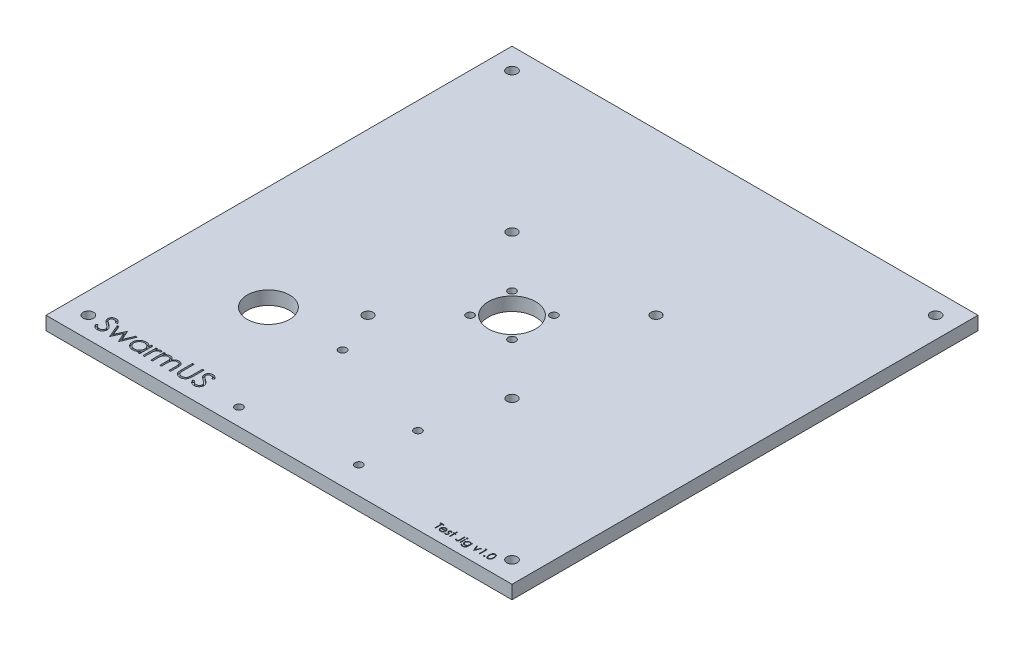
from build123d import *

# Parameters (mm, degrees)
ESQUISSE1_W                  = 220
ESQUISSE1_H                  = 220
BOSS_EXTRU_1_DEPTH           = 6.35
ESQUISSE2_R                  = 11.15
ENL_V_MAT_EXTRU_1_DEPTH      = 6.35
D_GAGEMENT_M31_D             = 3.6
D_GAGEMENT_M41_D             = 4.8
R_P_TITION_CIRCULAIRE1_COUNT = 4
F_8_CLEARANCE_HOLE1_D        = 4.9149
M3_CLEARANCE_HOLE1_D         = 3.6
SKETCH6_R                    = 10
CUT_EXTRUDE1_DEPTH           = 6.35
CUT_EXTRUDE2_DEPTH           = 1
SKETCH7_W                    = 0.314102564
SKETCH7_H                    = 2.557692308
CUT_EXTRUDE3_DEPTH           = 1


with BuildPart() as part:
    # Esquisse1 → Boss.-Extru.1 (new body)
    with BuildSketch(Plane(origin=(0, 0, 0), x_dir=(1, 0, 0), z_dir=(0, 1, 0))):
        Rectangle(ESQUISSE1_W, ESQUISSE1_H)
    extrude(amount=BOSS_EXTRU_1_DEPTH)

    # Esquisse2 → Enlèv. mat.-Extru.1 (cut)
    with BuildSketch(Plane(origin=(0, 6.35, 0), x_dir=(1, 0, 0), z_dir=(0, 1, 0))):
        with Locations(Location((0, 0, 0), (0, 0, 270))):
            Circle(ESQUISSE2_R)
    extrude(amount=-ENL_V_MAT_EXTRU_1_DEPTH, mode=Mode.SUBTRACT)

    # Dégagement M31 (through all)
    with Locations(Plane(origin=(0, 6.35, 0), x_dir=(1, 0, 0), z_dir=(0, 1, 0))):
        with Locations((-9.899494937, 9.899494937)):
            d_gagement_m31 = Hole(D_GAGEMENT_M31_D / 2)

    # Dégagement M41 (through all)
    with Locations(Plane(origin=(0, 6.35, 0), x_dir=(1, 0, 0), z_dir=(0, 1, 0))):
        with Locations((-34, 34)):
            d_gagement_m41 = Hole(D_GAGEMENT_M41_D / 2)

    # Répétition circulaire1: Dégagement M31, Dégagement M41 ×4 about axis
    r_p_tition_circulaire1_axis = Axis((0, 0, 0), (0, 1, 0))
    add([d_gagement_m31.rotate(r_p_tition_circulaire1_axis, i * 360 / R_P_TITION_CIRCULAIRE1_COUNT) for i in range(1, R_P_TITION_CIRCULAIRE1_COUNT)], mode=Mode.SUBTRACT)
    add([d_gagement_m41.rotate(r_p_tition_circulaire1_axis, i * 360 / R_P_TITION_CIRCULAIRE1_COUNT) for i in range(1, R_P_TITION_CIRCULAIRE1_COUNT)], mode=Mode.SUBTRACT)

    # #8 Clearance Hole1 (through all)
    with Locations(Plane(origin=(0, 6.35, 0), x_dir=(1, 0, 0), z_dir=(0, 1, 0))):
        with Locations((-100, 100), (100, 100), (100, -100), (-100, -100)):
            Hole(F_8_CLEARANCE_HOLE1_D / 2)

    # M3 Clearance Hole1 (through all)
    with Locations(Plane(origin=(0, 6.35, 0), x_dir=(1, 0, 0), z_dir=(0, 1, 0))):
        with Locations((25, -69.4), (-25.8, -54.2), (-26.9, -102), (25, -97.3)):
            Hole(M3_CLEARANCE_HOLE1_D / 2)

    # Sketch6 → Cut-Extrude1 (cut)
    with BuildSketch(Plane(origin=(0, 6.35, 0), x_dir=(1, 0, 0), z_dir=(0, 1, 0))):
        with Locations(Location((-60.8, -54.2, 0), (0, 0, 270))):
            Circle(SKETCH6_R)
    extrude(amount=-CUT_EXTRUDE1_DEPTH, mode=Mode.SUBTRACT)

    # Sketch9 → Cut-Extrude2 (cut)
    # profile 1 of 7: a face of its own
    with BuildSketch(Plane(origin=(0, 6.35, 0), x_dir=(1, 0, 0), z_dir=(0, 1, 0))):
        with BuildLine():
            Line((-94.596223628, -101.960859543), (-93.877673948, -101.53007028))
            add(Edge.make_bspline(
                [(-93.877673948, -101.53007028), (-93.810843943, -101.641940929), (-93.682800233, -101.856280776), (-93.469204075, -102.145907445), (-93.247881291, -102.392072683), (-93.01719291, -102.593344444), (-92.778547036, -102.751806026), (-92.530385762, -102.864011446), (-92.273545365, -102.933993101), (-92.098751798, -102.942493311), (-92.011488051, -102.946736946)],
                knots=[0, 0, 0, 0, 1.272034388, 2.437168799, 3.508375237, 4.49857839, 5.41946034, 6.295179144, 7.148887113, 8, 8, 8, 8], degree=3))
            add(Edge.make_bspline(
                [(-92.011488051, -102.946736946), (-91.936962818, -102.944661313), (-91.789216369, -102.940546365), (-91.571708065, -102.901007275), (-91.360466545, -102.840263533), (-91.159845568, -102.753269842), (-90.972613361, -102.648019234), (-90.808425672, -102.520892803), (-90.666485112, -102.378563446), (-90.550377262, -102.219776999), (-90.461297176, -102.049006781), (-90.392830725, -101.873722328), (-90.354835546, -101.691170091), (-90.349112002, -101.568258967), (-90.346223628, -101.506232139)],
                knots=[0, 0, 0, 0, 1.095163259, 2.171163733, 3.241058638, 4.321873601, 5.38011039, 6.391990106, 7.366004449, 8.327778327, 9.272591725, 10.192022065, 11.087607919, 12, 12, 12, 12], degree=3))
            add(Edge.make_bspline(
                [(-90.346223628, -101.506232139), (-90.349804096, -101.435461504), (-90.357082666, -101.291595144), (-90.418601975, -101.079338844), (-90.515378717, -100.86928546), (-90.604659424, -100.739353815), (-90.651011288, -100.671897203)],
                knots=[0, 0, 0, 0, 0.938893495, 1.908633276, 2.914225137, 4, 4, 4, 4], degree=3))
            add(Edge.make_bspline(
                [(-90.651011288, -100.671897203), (-90.689068494, -100.62321206), (-90.768964837, -100.521003692), (-90.906318796, -100.368865263), (-91.067493645, -100.211934817), (-91.246973707, -100.044219964), (-91.451296923, -99.873521029), (-91.674063744, -99.691698069), (-91.920961687, -99.505665667), (-92.094117607, -99.380903722), (-92.183463211, -99.316528613)],
                knots=[0, 0, 0, 0, 0.722233717, 1.516239348, 2.393582979, 3.351407094, 4.387010283, 5.505090956, 6.712668013, 8, 8, 8, 8], degree=3))
            add(Edge.make_bspline(
                [(-92.183463211, -99.316528613), (-92.272892916, -99.252830615), (-92.443875702, -99.131044892), (-92.682989402, -98.950300202), (-92.896811669, -98.785050805), (-93.084392138, -98.633741061), (-93.245648302, -98.49635045), (-93.381850871, -98.374198312), (-93.489530224, -98.263981093), (-93.549408063, -98.192480691), (-93.576291737, -98.160378773)],
                knots=[0, 0, 0, 0, 1.452282411, 2.77665338, 3.964542531, 5.026858415, 5.96415736, 6.766646006, 7.446254459, 8, 8, 8, 8], degree=3))
            add(Edge.make_bspline(
                [(-93.576291737, -98.160378773), (-93.613867918, -98.110347684), (-93.687766521, -98.011954832), (-93.785312535, -97.858165892), (-93.86822193, -97.700737961), (-93.933216165, -97.539248005), (-93.987946982, -97.375963177), (-94.0247591, -97.208753009), (-94.047809635, -97.038367793), (-94.050170174, -96.923706434), (-94.051351833, -96.866308261)],
                knots=[0, 0, 0, 0, 1.068054152, 2.10047183, 3.106115577, 4.101338837, 5.06977816, 6.043150881, 7.020423561, 8, 8, 8, 8], degree=3))
            add(Edge.make_bspline(
                [(-94.051351833, -96.866308261), (-94.048182039, -96.776378808), (-94.041910205, -96.598442082), (-93.988868949, -96.338510065), (-93.905149064, -96.090343052), (-93.787861479, -95.856397956), (-93.636665051, -95.642766288), (-93.461696256, -95.446990677), (-93.253296932, -95.282409834), (-93.024640561, -95.138609121), (-92.774360801, -95.026054731), (-92.512097178, -94.941149493), (-92.23743286, -94.893041296), (-92.051396676, -94.886137439), (-91.957000871, -94.882634382)],
                knots=[0, 0, 0, 0, 1.005424448, 1.989358655, 2.955360095, 3.929531133, 4.905563448, 5.876582895, 6.856512386, 7.866279853, 8.892233794, 9.918561126, 10.94386622, 12, 12, 12, 12], degree=3))
            add(Edge.make_bspline(
                [(-91.957000871, -94.882634382), (-91.856836628, -94.886089151), (-91.657641916, -94.892959582), (-91.364636678, -94.952696444), (-91.082532081, -95.051540932), (-90.855598438, -95.163713387), (-90.677990303, -95.275746825), (-90.542542238, -95.37779497), (-90.405285572, -95.495277377), (-90.265113153, -95.628506974), (-90.124400123, -95.778706227), (-89.981057453, -95.944846472), (-89.834749943, -96.125912393), (-89.740628569, -96.255171895), (-89.692377474, -96.321436466)],
                knots=[0, 0, 0, 0, 1.286793592, 2.559021753, 3.825965368, 5.121522368, 5.803751409, 6.523245864, 7.299691795, 8.125521123, 9.008227632, 9.944561021, 10.946284179, 12, 12, 12, 12], degree=3))
            Line((-89.692377474, -96.321436466), (-90.381980839, -96.844172844))
            add(Edge.make_bspline(
                [(-90.381980839, -96.844172844), (-90.423620961, -96.790528881), (-90.503810099, -96.687223152), (-90.625553139, -96.542549957), (-90.740299855, -96.41039565), (-90.853350826, -96.29560891), (-90.95873536, -96.191903729), (-91.061019605, -96.103115748), (-91.158731601, -96.028375017), (-91.281901241, -95.948612085), (-91.436644271, -95.869546291), (-91.630892431, -95.802641387), (-91.83388767, -95.762436237), (-91.972145347, -95.757120367), (-92.042137089, -95.754429254)],
                knots=[0, 0, 0, 0, 1.181633172, 2.275549214, 3.290209073, 4.226197932, 5.078386478, 5.862611352, 6.581680152, 7.217281963, 8.414376989, 9.595101626, 10.782541182, 12, 12, 12, 12], degree=3))
            add(Edge.make_bspline(
                [(-92.042137089, -95.754429254), (-92.129945786, -95.757371954), (-92.299276587, -95.763046674), (-92.539681446, -95.825023781), (-92.756052407, -95.922608299), (-92.94196578, -96.059373245), (-93.096755581, -96.221409942), (-93.208725981, -96.407872876), (-93.276119238, -96.613772996), (-93.28434306, -96.757402733), (-93.28853132, -96.830551049)],
                knots=[0, 0, 0, 0, 1.14458467, 2.207223713, 3.21896685, 4.227309161, 5.202851033, 6.127160689, 7.046193047, 8, 8, 8, 8], degree=3))
            add(Edge.make_bspline(
                [(-93.28853132, -96.830551049), (-93.287576584, -96.876090354), (-93.28566555, -96.96724343), (-93.25901247, -97.101911169), (-93.224771243, -97.236238707), (-93.170510566, -97.369622123), (-93.095600543, -97.504394138), (-92.99723083, -97.6428755), (-92.873341358, -97.786286793), (-92.778440042, -97.879561844), (-92.728335006, -97.928808261)],
                knots=[0, 0, 0, 0, 0.858281714, 1.717966888, 2.583508476, 3.4729293, 4.427298488, 5.488583878, 6.674047936, 8, 8, 8, 8], degree=3))
            add(Edge.make_bspline(
                [(-92.728335006, -97.928808261), (-92.709728816, -97.945412466), (-92.665524767, -97.984860258), (-92.584711804, -98.049441511), (-92.47799358, -98.129105386), (-92.348156806, -98.227674584), (-92.192807499, -98.342015277), (-92.011928577, -98.470665478), (-91.807536283, -98.617801593), (-91.662497344, -98.720669906), (-91.585806961, -98.775062267)],
                knots=[0, 0, 0, 0, 0.420754252, 0.999615792, 1.744751191, 2.668019286, 3.750313428, 4.999500688, 6.413464383, 8, 8, 8, 8], degree=3))
            add(Edge.make_bspline(
                [(-91.585806961, -98.775062267), (-91.493555457, -98.842191283), (-91.314923206, -98.972177319), (-91.060754798, -99.167472542), (-90.830298407, -99.358474265), (-90.622744912, -99.54396274), (-90.436043849, -99.722530966), (-90.272266527, -99.896327261), (-90.129744161, -100.064106509), (-89.976308916, -100.279211335), (-89.81952564, -100.543393969), (-89.684881979, -100.867069691), (-89.599983135, -101.192003612), (-89.588880883, -101.410397358), (-89.583403115, -101.518151209)],
                knots=[0, 0, 0, 0, 1.163667725, 2.253281268, 3.268753668, 4.215851969, 5.092017293, 5.902905408, 6.650798638, 7.335211899, 8.59617414, 9.77448103, 10.901945474, 12, 12, 12, 12], degree=3))
            add(Edge.make_bspline(
                [(-89.583403115, -101.518151209), (-89.584999022, -101.59435581), (-89.588159844, -101.74528517), (-89.624493492, -101.966904643), (-89.677726964, -102.182151041), (-89.757960247, -102.388363742), (-89.855887917, -102.589315309), (-89.980148804, -102.779734495), (-90.124181753, -102.963835749), (-90.289406611, -103.136709942), (-90.470203802, -103.295407847), (-90.661292775, -103.436578425), (-90.862986295, -103.55428721), (-91.074190207, -103.650339255), (-91.294953024, -103.725463512), (-91.525200499, -103.779894766), (-91.76531217, -103.813301492), (-91.928513339, -103.816768913), (-92.011488051, -103.818531818)],
                knots=[0, 0, 0, 0, 0.983748083, 1.948392443, 2.894712957, 3.844097841, 4.80183111, 5.778335162, 6.776009319, 7.81870978, 8.863265674, 9.881300176, 10.883814829, 11.87499822, 12.874611388, 13.892143829, 14.928324115, 16, 16, 16, 16], degree=3))
            add(Edge.make_bspline(
                [(-92.011488051, -103.818531818), (-92.075688169, -103.817290377), (-92.203279872, -103.81482313), (-92.3920029, -103.793011449), (-92.576913331, -103.76215134), (-92.755690873, -103.71315717), (-92.930638872, -103.653713083), (-93.100996442, -103.58051999), (-93.266846144, -103.492806786), (-93.429117417, -103.392518869), (-93.587397555, -103.275807204), (-93.740201977, -103.13987157), (-93.892544285, -102.988461057), (-94.039927962, -102.817463975), (-94.185334169, -102.629642917), (-94.325896021, -102.423240614), (-94.46452305, -102.199381326), (-94.551503472, -102.041851833), (-94.596223628, -101.960859543)],
                knots=[0, 0, 0, 0, 0.915332311, 1.819136955, 2.706846663, 3.586547465, 4.459518054, 5.340707479, 6.227863349, 7.133153174, 8.059268498, 9.028702269, 10.047606654, 11.120612155, 12.245963614, 13.433783089, 14.680604001, 16, 16, 16, 16], degree=3))
        make_face()
    # profile 2 of 7: a face of its own
    with BuildSketch(Plane(origin=(0, 6.35, 0), x_dir=(1, 0, 0), z_dir=(0, 1, 0))):
        Polygon((-88.929556961, -97.389044639), (-88.110546544, -97.389044639), (-86.259685166, -101.856993357), (-84.231740455, -97.389044639), (-84.102333403, -97.389044639), (-82.118659525, -101.856993357), (-80.250770903, -97.389044639), (-79.44878773, -97.389044639), (-82.045442378, -103.6005831), (-82.203795743, -103.6005831), (-84.189172346, -99.132634382), (-86.215414333, -103.6005831), (-86.356740455, -103.6005831), align=None)
    # profile 3 of 7: a face of its own
    with BuildSketch(Plane(origin=(0, 6.35, 0), x_dir=(1, 0, 0), z_dir=(0, 1, 0))):
        with BuildLine():
            Line((-72.147505679, -97.389044639), (-72.147505679, -103.6005831))
            Line((-72.147505679, -103.6005831), (-72.910326192, -103.6005831))
            Line((-72.910326192, -103.6005831), (-72.910326192, -102.52616403))
            add(Edge.make_bspline(
                [(-72.910326192, -102.52616403), (-72.996343255, -102.623403044), (-73.164206635, -102.813166202), (-73.444563635, -103.06108005), (-73.741743496, -103.26599883), (-74.054303847, -103.431505769), (-74.381962438, -103.555829334), (-74.723992936, -103.64419572), (-75.080534861, -103.70100932), (-75.324004865, -103.706682516), (-75.447385487, -103.709557459)],
                knots=[0, 0, 0, 0, 1.074387032, 2.096679803, 3.090159297, 4.057316773, 5.018401886, 5.985159533, 6.978961417, 8, 8, 8, 8], degree=3))
            add(Edge.make_bspline(
                [(-75.447385487, -103.709557459), (-75.557079089, -103.706579127), (-75.773399729, -103.700705723), (-76.091613202, -103.655140128), (-76.397837237, -103.581965761), (-76.692361199, -103.480206458), (-76.973279266, -103.345224463), (-77.242996644, -103.183624289), (-77.500116039, -102.991182273), (-77.740718348, -102.771182776), (-77.962281777, -102.532223521), (-78.156716296, -102.277355765), (-78.318830919, -102.007681598), (-78.454393972, -101.726615367), (-78.558813666, -101.43199342), (-78.631606778, -101.124834583), (-78.677119291, -100.805502033), (-78.682990267, -100.588048906), (-78.685967217, -100.477786626)],
                knots=[0, 0, 0, 0, 1.033919861, 2.038935746, 3.024066025, 3.998881131, 4.97069526, 5.957263378, 6.95902576, 7.993208707, 9.027059324, 10.027763471, 11.009749337, 11.988697705, 12.965288445, 13.950418724, 14.960734635, 16, 16, 16, 16], degree=3))
            add(Edge.make_bspline(
                [(-78.685967217, -100.477786626), (-78.682924287, -100.369803346), (-78.676908577, -100.156326226), (-78.632093615, -99.842363674), (-78.556732594, -99.539962184), (-78.450973535, -99.250095322), (-78.315357359, -98.972412343), (-78.150389148, -98.706716853), (-77.956056988, -98.452276888), (-77.732015428, -98.215075337), (-77.4893167, -97.995968131), (-77.229681211, -97.805546164), (-76.959567528, -97.641090959), (-76.674785931, -97.51078966), (-76.379551533, -97.405367549), (-76.071236022, -97.332430341), (-75.751122188, -97.289451132), (-75.533788136, -97.283227276), (-75.423547346, -97.28007028)],
                knots=[0, 0, 0, 0, 1.020392517, 2.01726096, 2.990465484, 3.961182959, 4.928053699, 5.906110375, 6.912531644, 7.948652711, 8.985773172, 9.998621852, 10.987621588, 11.969261332, 12.953316658, 13.946091881, 14.958173133, 16, 16, 16, 16], degree=3))
            add(Edge.make_bspline(
                [(-75.423547346, -97.28007028), (-75.296776259, -97.283561962), (-75.048184142, -97.290408986), (-74.684558977, -97.347389896), (-74.340565245, -97.443654744), (-74.013547533, -97.57459724), (-73.704680152, -97.748601296), (-73.41688719, -97.968095487), (-73.147156731, -98.231695512), (-72.990804594, -98.434166592), (-72.910326192, -98.538383581)],
                knots=[0, 0, 0, 0, 1.038897134, 2.037228247, 3.008116434, 3.962042015, 4.918381754, 5.904844433, 6.921570401, 8, 8, 8, 8], degree=3))
            Line((-72.910326192, -98.538383581), (-72.910326192, -97.389044639))
            Line((-72.910326192, -97.389044639), (-72.147505679, -97.389044639))
        make_face()
        with BuildLine():
            add(Edge.make_bspline(
                [(-75.413330999, -98.042890793), (-75.524837249, -98.046858199), (-75.744932848, -98.054689227), (-76.068039711, -98.115824858), (-76.377229431, -98.217544587), (-76.670955611, -98.356657776), (-76.944578423, -98.531584707), (-77.189120195, -98.74316521), (-77.406581041, -98.98562653), (-77.58947254, -99.257874512), (-77.738563747, -99.549735591), (-77.843397967, -99.854823512), (-77.912537568, -100.1676356), (-77.919601118, -100.379802123), (-77.923146705, -100.486300248)],
                knots=[0, 0, 0, 0, 1.031046209, 2.035121221, 3.029706178, 4.034933723, 5.034054252, 6.02443088, 7.017295772, 8.038157696, 9.050218397, 10.03989886, 11.016116709, 12, 12, 12, 12], degree=3))
            add(Edge.make_bspline(
                [(-77.923146705, -100.486300248), (-77.918617678, -100.592161937), (-77.909577377, -100.803470372), (-77.844611405, -101.116708916), (-77.735617427, -101.421868732), (-77.586886703, -101.716359717), (-77.400647757, -101.989778246), (-77.184775315, -102.236861401), (-76.937181775, -102.449336115), (-76.662929258, -102.627198794), (-76.370024187, -102.770879202), (-76.061998924, -102.870852898), (-75.744643803, -102.935398936), (-75.528859564, -102.94293838), (-75.420141897, -102.946736946)],
                knots=[0, 0, 0, 0, 0.979072187, 1.954306742, 2.945804271, 3.96968567, 4.997920485, 5.998718438, 6.996577872, 8.005894225, 9.015743152, 10.005417472, 10.995077863, 12, 12, 12, 12], degree=3))
            add(Edge.make_bspline(
                [(-75.420141897, -102.946736946), (-75.309771819, -102.942705606), (-75.09025668, -102.934687668), (-74.766191247, -102.87329031), (-74.45170348, -102.771851799), (-74.151077354, -102.631239634), (-73.871023892, -102.45697177), (-73.619671904, -102.252954549), (-73.407133124, -102.015675388), (-73.226951072, -101.754904002), (-73.085667917, -101.46903201), (-72.98275463, -101.164648976), (-72.92190943, -100.841744301), (-72.914240659, -100.621074765), (-72.910326192, -100.508435664)],
                knots=[0, 0, 0, 0, 1.01762866, 2.023962475, 3.030623092, 4.058876274, 5.077231937, 6.066672613, 7.034107872, 8.005628644, 8.981990164, 9.965428785, 10.961468474, 12, 12, 12, 12], degree=3))
            add(Edge.make_bspline(
                [(-72.910326192, -100.508435664), (-72.912656786, -100.422615219), (-72.917244132, -100.253693424), (-72.952289801, -100.005669452), (-73.00803748, -99.768316118), (-73.086592464, -99.541383873), (-73.189785583, -99.326127407), (-73.314244443, -99.121001132), (-73.462157678, -98.927071904), (-73.631144226, -98.747010161), (-73.816116861, -98.582774467), (-74.011846459, -98.436175596), (-74.220651988, -98.31574572), (-74.439021935, -98.21607406), (-74.667335175, -98.136758982), (-74.907449538, -98.083846011), (-75.156812792, -98.047513803), (-75.326924641, -98.044448021), (-75.413330999, -98.042890793)],
                knots=[0, 0, 0, 0, 1.050140795, 2.067009409, 3.05949893, 4.030605086, 5.00011959, 5.97591094, 6.962425594, 7.979863591, 8.993523472, 9.986985069, 10.967611495, 11.937549037, 12.921786183, 13.919465291, 14.943216303, 16, 16, 16, 16], degree=3))
        make_face(mode=Mode.SUBTRACT)
    # profile 4 of 7: a face of its own
    with BuildSketch(Plane(origin=(0, 6.35, 0), x_dir=(1, 0, 0), z_dir=(0, 1, 0))):
        with BuildLine():
            Line((-70.621864653, -97.389044639), (-69.85904414, -97.389044639))
            Line((-69.85904414, -97.389044639), (-69.85904414, -98.30340762))
            add(Edge.make_bspline(
                [(-69.85904414, -98.30340762), (-69.802728583, -98.218272036), (-69.695025518, -98.055450895), (-69.516008404, -97.840111164), (-69.332643171, -97.66181748), (-69.144052002, -97.519737506), (-68.948848045, -97.413334217), (-68.751315448, -97.335393989), (-68.54834645, -97.289306224), (-68.411953205, -97.283153052), (-68.343619461, -97.28007028)],
                knots=[0, 0, 0, 0, 1.2804753, 2.448899062, 3.506932113, 4.484331642, 5.4025378, 6.288909075, 7.142734305, 8, 8, 8, 8], degree=3))
            add(Edge.make_bspline(
                [(-68.343619461, -97.28007028), (-68.290612668, -97.282961559), (-68.181547747, -97.288910553), (-68.016447172, -97.33070827), (-67.846341646, -97.39744061), (-67.736710134, -97.460195437), (-67.679556961, -97.492910825)],
                knots=[0, 0, 0, 0, 0.901110191, 1.854092781, 2.881294221, 4, 4, 4, 4], degree=3))
            Line((-67.679556961, -97.492910825), (-68.098427153, -98.153567876))
            add(Edge.make_bspline(
                [(-68.098427153, -98.153567876), (-68.13512049, -98.137198658), (-68.204771468, -98.106126749), (-68.306661129, -98.069353296), (-68.400601519, -98.047700358), (-68.46045016, -98.044420044), (-68.488351031, -98.042890793)],
                knots=[0, 0, 0, 0, 1.180555205, 2.24091978, 3.179933427, 4, 4, 4, 4], degree=3))
            add(Edge.make_bspline(
                [(-68.488351031, -98.042890793), (-68.549564956, -98.046970883), (-68.674423617, -98.055293086), (-68.857743116, -98.120715905), (-69.035629186, -98.226420059), (-69.176903223, -98.343649902), (-69.286291552, -98.456694553), (-69.364346385, -98.555412102), (-69.435947342, -98.666103065), (-69.504360734, -98.786875154), (-69.566693163, -98.919790494), (-69.624868788, -99.063521155), (-69.677468884, -99.218233611), (-69.707462334, -99.326019732), (-69.722826192, -99.381232139)],
                knots=[0, 0, 0, 0, 1.125678352, 2.296057538, 3.5422874, 4.923748041, 5.663163013, 6.437101912, 7.23742474, 8.08941207, 8.991984279, 9.93940061, 10.944477711, 12, 12, 12, 12], degree=3))
            add(Edge.make_bspline(
                [(-69.722826192, -99.381232139), (-69.734319147, -99.430476703), (-69.75977517, -99.539549671), (-69.784526047, -99.722538946), (-69.808980591, -99.93873926), (-69.826215236, -100.188752414), (-69.842190481, -100.471954063), (-69.85120068, -100.788775646), (-69.858736879, -101.139542356), (-69.858938613, -101.384765785), (-69.85904414, -101.513043036)],
                knots=[0, 0, 0, 0, 0.566838948, 1.255505196, 2.06880316, 3.007127437, 4.065329342, 5.249902469, 6.561414163, 8, 8, 8, 8], degree=3))
            Line((-69.85904414, -101.513043036), (-69.85904414, -103.6005831))
            Line((-69.85904414, -103.6005831), (-70.621864653, -103.6005831))
            Line((-70.621864653, -103.6005831), (-70.621864653, -97.389044639))
        make_face()
    # profile 5 of 7: a face of its own
    with BuildSketch(Plane(origin=(0, 6.35, 0), x_dir=(1, 0, 0), z_dir=(0, 1, 0))):
        with BuildLine():
            Line((-66.916736448, -97.389044639), (-66.153915935, -97.389044639))
            Line((-66.153915935, -97.389044639), (-66.153915935, -98.468571882))
            add(Edge.make_bspline(
                [(-66.153915935, -98.468571882), (-66.085226343, -98.374130564), (-65.953610498, -98.193171944), (-65.737793913, -97.954709825), (-65.522194783, -97.752341449), (-65.366927999, -97.646108761), (-65.29233741, -97.595074286)],
                knots=[0, 0, 0, 0, 1.134379233, 2.173579362, 3.122582517, 4, 4, 4, 4], degree=3))
            add(Edge.make_bspline(
                [(-65.29233741, -97.595074286), (-65.190666087, -97.546489828), (-64.989099759, -97.450169738), (-64.669938784, -97.352459666), (-64.343357444, -97.292412992), (-64.12282321, -97.284201085), (-64.011888692, -97.28007028)],
                knots=[0, 0, 0, 0, 1.014936303, 2.012140481, 3.000054389, 4, 4, 4, 4], degree=3))
            add(Edge.make_bspline(
                [(-64.011888692, -97.28007028), (-63.936862843, -97.282608843), (-63.788390722, -97.287632523), (-63.568400789, -97.32032118), (-63.355029875, -97.376824743), (-63.149538661, -97.455528244), (-62.955931297, -97.550841627), (-62.778428959, -97.662676632), (-62.619055882, -97.788226672), (-62.477892615, -97.933161224), (-62.350953553, -98.101550106), (-62.23419064, -98.29793471), (-62.126300838, -98.526724744), (-62.066506231, -98.692757772), (-62.035025711, -98.78017044)],
                knots=[0, 0, 0, 0, 1.009824226, 1.998387844, 2.986035974, 3.974953746, 4.955485308, 5.885931332, 6.793869504, 7.679848016, 8.601185859, 9.625726857, 10.749998409, 12, 12, 12, 12], degree=3))
            add(Edge.make_bspline(
                [(-62.035025711, -98.78017044), (-62.001726958, -98.720125422), (-61.936199687, -98.601965258), (-61.826171712, -98.43473805), (-61.710892777, -98.278321556), (-61.589380437, -98.132591668), (-61.462063583, -97.998268037), (-61.32834304, -97.874906561), (-61.188979999, -97.761977471), (-60.995198845, -97.630049798), (-60.743082513, -97.489918357), (-60.425211377, -97.368420708), (-60.09456096, -97.293338682), (-59.870117979, -97.284522305), (-59.756780519, -97.28007028)],
                knots=[0, 0, 0, 0, 0.86119277, 1.694706429, 2.50939023, 3.298075842, 4.073795165, 4.829715201, 5.57930267, 6.321991688, 7.768977793, 9.186738141, 10.579381044, 12, 12, 12, 12], degree=3))
            add(Edge.make_bspline(
                [(-59.756780519, -97.28007028), (-59.652639823, -97.283997816), (-59.448826371, -97.291684386), (-59.152110154, -97.352042821), (-58.875394341, -97.455688536), (-58.619235728, -97.597113082), (-58.388133324, -97.774833956), (-58.187250859, -97.986286847), (-58.017808548, -98.229976074), (-57.907117566, -98.459213761), (-57.832037638, -98.661599569), (-57.785746069, -98.83404342), (-57.744849667, -99.023840048), (-57.710895214, -99.231216398), (-57.68607873, -99.456905018), (-57.667692707, -99.700536574), (-57.655248528, -99.962300416), (-57.65436921, -100.142902345), (-57.653915935, -100.235999767)],
                knots=[0, 0, 0, 0, 1.209669288, 2.367440248, 3.500751976, 4.631527125, 5.755587489, 6.87532382, 8.007944318, 9.190864318, 9.82315674, 10.514484317, 11.263564316, 12.079023757, 12.955305781, 13.901327259, 14.918167583, 16, 16, 16, 16], degree=3))
            Line((-57.653915935, -100.235999767), (-57.653915935, -103.6005831))
            Line((-57.653915935, -103.6005831), (-58.416736448, -103.6005831))
            Line((-58.416736448, -103.6005831), (-58.416736448, -100.232594318))
            add(Edge.make_bspline(
                [(-58.416736448, -100.232594318), (-58.416925592, -100.153130067), (-58.417289099, -100.000411862), (-58.423830776, -99.781227338), (-58.436156539, -99.581432756), (-58.450569233, -99.401300542), (-58.470589913, -99.240410627), (-58.496444318, -99.099086182), (-58.523832969, -98.976215497), (-58.569334662, -98.840006524), (-58.642065256, -98.689750299), (-58.752850565, -98.527707329), (-58.892420823, -98.386653957), (-59.053581203, -98.264209473), (-59.237055997, -98.164653488), (-59.439270325, -98.093554607), (-59.658968736, -98.049541903), (-59.811052651, -98.045155865), (-59.889593019, -98.042890793)],
                knots=[0, 0, 0, 0, 1.253487763, 2.409012846, 3.458416907, 4.410876679, 5.259312806, 6.014470957, 6.676830364, 7.243083969, 8.276244668, 9.299465089, 10.325150304, 11.392391894, 12.482080715, 13.603491619, 14.762376348, 16, 16, 16, 16], degree=3))
            add(Edge.make_bspline(
                [(-59.889593019, -98.042890793), (-59.985934336, -98.046330032), (-60.176341406, -98.053127276), (-60.454280444, -98.122520968), (-60.721352913, -98.227144434), (-60.969589665, -98.378766115), (-61.19794287, -98.560443571), (-61.394413274, -98.776464017), (-61.55672001, -99.020850983), (-61.666622523, -99.247064403), (-61.736053683, -99.450261624), (-61.781897622, -99.627783813), (-61.817557287, -99.829553335), (-61.851, -100.054214384), (-61.87282734, -100.303313393), (-61.892664815, -100.575698081), (-61.901944054, -100.872187697), (-61.903242025, -101.077709655), (-61.903915935, -101.184417235)],
                knots=[0, 0, 0, 0, 1.090531906, 2.155305635, 3.229839962, 4.33261226, 5.44038871, 6.529323825, 7.629011124, 8.757537029, 9.370236727, 10.061839251, 10.834451254, 11.692844982, 12.636905849, 13.66920014, 14.789842145, 16, 16, 16, 16], degree=3))
            Line((-61.903915935, -101.184417235), (-61.903915935, -103.6005831))
            Line((-61.903915935, -103.6005831), (-62.666736448, -103.6005831))
            Line((-62.666736448, -103.6005831), (-62.666736448, -100.442029414))
            add(Edge.make_bspline(
                [(-62.666736448, -100.442029414), (-62.666929352, -100.352917069), (-62.667300479, -100.181473873), (-62.673800107, -99.935620661), (-62.686153331, -99.711995181), (-62.700434663, -99.51085734), (-62.720980811, -99.332572685), (-62.744318805, -99.176185415), (-62.771879716, -99.042087591), (-62.817512293, -98.895005085), (-62.88724743, -98.732968558), (-62.999418923, -98.560197507), (-63.139323047, -98.408974984), (-63.303423746, -98.279875166), (-63.488008974, -98.17316014), (-63.691968662, -98.096272172), (-63.913466307, -98.051527468), (-64.066169307, -98.045823976), (-64.144701192, -98.042890793)],
                knots=[0, 0, 0, 0, 1.320475261, 2.540461679, 3.643808994, 4.639130445, 5.527981419, 6.302341397, 6.981980563, 7.553956391, 8.582137848, 9.585246428, 10.591171744, 11.620968678, 12.668337649, 13.738356861, 14.836885341, 16, 16, 16, 16], degree=3))
            add(Edge.make_bspline(
                [(-64.144701192, -98.042890793), (-64.237026277, -98.046607624), (-64.421026892, -98.054015137), (-64.691331676, -98.120689802), (-64.952368336, -98.22512827), (-65.199972605, -98.370016402), (-65.427466965, -98.549485593), (-65.6266299, -98.760564625), (-65.794061747, -99.000626564), (-65.905124726, -99.224454675), (-65.976763878, -99.4225612), (-66.024352548, -99.59098493), (-66.065248782, -99.777985533), (-66.095639977, -99.984139946), (-66.12497813, -100.20810546), (-66.139137452, -100.450997792), (-66.152911245, -100.712608576), (-66.153572824, -100.893227615), (-66.153915935, -100.986901209)],
                knots=[0, 0, 0, 0, 1.098833095, 2.189935336, 3.297829714, 4.440610912, 5.596351641, 6.740013378, 7.886572111, 9.072425424, 9.705826452, 10.395263256, 11.156850408, 11.985370555, 12.878090359, 13.847760091, 14.883794034, 16, 16, 16, 16], degree=3))
            Line((-66.153915935, -100.986901209), (-66.153915935, -103.6005831))
            Line((-66.153915935, -103.6005831), (-66.916736448, -103.6005831))
            Line((-66.916736448, -103.6005831), (-66.916736448, -97.389044639))
        make_face()
    # profile 6 of 7: a face of its own
    with BuildSketch(Plane(origin=(0, 6.35, 0), x_dir=(1, 0, 0), z_dir=(0, 1, 0))):
        with BuildLine():
            Line((-55.692377474, -95.1005831), (-54.929556961, -95.1005831))
            Line((-54.929556961, -95.1005831), (-54.929556961, -100.193431658))
            add(Edge.make_bspline(
                [(-54.929556961, -100.193431658), (-54.929670482, -100.265513445), (-54.929885908, -100.402301057), (-54.928446946, -100.596995501), (-54.924417051, -100.770085759), (-54.921876378, -100.922239032), (-54.916224282, -101.052757133), (-54.911614739, -101.162347173), (-54.905687673, -101.250490236), (-54.898564388, -101.301929628), (-54.895502474, -101.324040632)],
                knots=[0, 0, 0, 0, 1.528628734, 2.90083645, 4.128790002, 5.200304208, 6.127813768, 6.898992206, 7.526736466, 8, 8, 8, 8], degree=3))
            add(Edge.make_bspline(
                [(-54.895502474, -101.324040632), (-54.882928645, -101.403811343), (-54.858489478, -101.558857971), (-54.796205418, -101.779635227), (-54.709220059, -101.978611626), (-54.606144098, -102.16199619), (-54.470307756, -102.324684636), (-54.307584884, -102.474555793), (-54.110438875, -102.605630175), (-53.891234547, -102.725482147), (-53.654970399, -102.821811633), (-53.413543038, -102.89465266), (-53.170581517, -102.939044274), (-53.007925116, -102.94418444), (-52.927153115, -102.946736946)],
                knots=[0, 0, 0, 0, 1.035780045, 2.013197591, 2.933192213, 3.817615948, 4.702609284, 5.640816605, 6.646850145, 7.73207398, 8.84249596, 9.914020372, 10.964143139, 12, 12, 12, 12], degree=3))
            add(Edge.make_bspline(
                [(-52.927153115, -102.946736946), (-52.857808317, -102.944129024), (-52.719519238, -102.938928243), (-52.514046478, -102.90672191), (-52.313931928, -102.848677679), (-52.11818742, -102.773781123), (-51.934706457, -102.674822688), (-51.76338667, -102.560507792), (-51.610474258, -102.426424236), (-51.470933406, -102.278037685), (-51.34941999, -102.110612456), (-51.244090075, -101.927794121), (-51.157812817, -101.726831421), (-51.115207114, -101.585599253), (-51.09331898, -101.513043036)],
                knots=[0, 0, 0, 0, 0.994687771, 1.983630487, 2.973142513, 3.978332533, 4.983357753, 5.956394766, 6.925816176, 7.893390482, 8.871859704, 9.88551698, 10.913711441, 12, 12, 12, 12], degree=3))
            add(Edge.make_bspline(
                [(-51.09331898, -101.513043036), (-51.086032962, -101.483053641), (-51.069796776, -101.416225184), (-51.054625381, -101.303244907), (-51.038823819, -101.169942166), (-51.027859864, -101.015359192), (-51.017171185, -100.840013973), (-51.01077658, -100.642993062), (-51.007820929, -100.425011871), (-51.006940134, -100.27289305), (-51.006480038, -100.193431658)],
                knots=[0, 0, 0, 0, 0.558680831, 1.244966039, 2.062412453, 2.990489873, 4.051219941, 5.244515665, 6.560634259, 8, 8, 8, 8], degree=3))
            Line((-51.006480038, -100.193431658), (-51.006480038, -95.1005831))
            Line((-51.006480038, -95.1005831), (-50.243659525, -95.1005831))
            Line((-50.243659525, -95.1005831), (-50.243659525, -100.234297043))
            add(Edge.make_bspline(
                [(-50.243659525, -100.234297043), (-50.244276675, -100.326821677), (-50.245481079, -100.507389127), (-50.255925337, -100.771985285), (-50.27257805, -101.022985382), (-50.296106264, -101.26042316), (-50.327281843, -101.483448975), (-50.361950236, -101.694017698), (-50.40610053, -101.890617823), (-50.457667362, -102.074782265), (-50.516617407, -102.250089941), (-50.592974482, -102.416468005), (-50.67900541, -102.578974404), (-50.781040996, -102.73515124), (-50.895697211, -102.885690012), (-51.025508435, -103.029677765), (-51.166181398, -103.169415449), (-51.320054614, -103.30131861), (-51.484591604, -103.42228254), (-51.659302929, -103.528648555), (-51.842846513, -103.618563055), (-52.034745248, -103.692576014), (-52.235081026, -103.748225755), (-52.4438589, -103.78969399), (-52.661554084, -103.813256713), (-52.809611106, -103.816758543), (-52.884585006, -103.818531818)],
                knots=[0, 0, 0, 0, 1.316592851, 2.569410997, 3.76748051, 4.895814652, 5.963796859, 6.97159953, 7.931736103, 8.829262218, 9.692595152, 10.560224239, 11.431080259, 12.30701507, 13.211635791, 14.121146779, 15.063487852, 16.031507147, 17.00238618, 17.966455255, 18.938106653, 19.907068911, 20.888905087, 21.893141452, 22.933117798, 24, 24, 24, 24], degree=3))
            add(Edge.make_bspline(
                [(-52.884585006, -103.818531818), (-52.966352826, -103.81662596), (-53.126780998, -103.812886672), (-53.363173447, -103.791459993), (-53.589793638, -103.751101036), (-53.809035054, -103.699712601), (-54.017912833, -103.62883781), (-54.219225483, -103.546028079), (-54.409525137, -103.444326161), (-54.591899021, -103.331170778), (-54.761473429, -103.203853799), (-54.917138551, -103.065084805), (-55.059151379, -102.917086746), (-55.185118213, -102.758257286), (-55.297126076, -102.589831712), (-55.393613737, -102.411333558), (-55.476460187, -102.222831933), (-55.519218993, -102.091802732), (-55.540835006, -102.025563068)],
                knots=[0, 0, 0, 0, 1.13879206, 2.234305948, 3.301075583, 4.341971843, 5.366689343, 6.369221514, 7.369726634, 8.367512178, 9.355451585, 10.318319045, 11.268648973, 12.207971039, 13.137398894, 14.081662264, 15.030215811, 16, 16, 16, 16], degree=3))
            add(Edge.make_bspline(
                [(-55.540835006, -102.025563068), (-55.553408104, -101.98031253), (-55.580679435, -101.882163106), (-55.609883729, -101.719724491), (-55.634434356, -101.532688262), (-55.657519283, -101.321041618), (-55.671141038, -101.084620513), (-55.683083389, -100.823527432), (-55.692461606, -100.537446667), (-55.692406302, -100.338171415), (-55.692377474, -100.234297043)],
                knots=[0, 0, 0, 0, 0.625038921, 1.35572334, 2.194682327, 3.136881307, 4.189498639, 5.346923369, 6.617055217, 8, 8, 8, 8], degree=3))
            Line((-55.692377474, -100.234297043), (-55.692377474, -95.1005831))
        make_face()
    # profile 7 of 7: a face of its own
    with BuildSketch(Plane(origin=(0, 6.35, 0), x_dir=(1, 0, 0), z_dir=(0, 1, 0))):
        with BuildLine():
            Line((-48.935967217, -101.960859543), (-48.217417538, -101.53007028))
            add(Edge.make_bspline(
                [(-48.217417538, -101.53007028), (-48.150587533, -101.641940929), (-48.022543823, -101.856280776), (-47.808947665, -102.145907445), (-47.587624881, -102.392072683), (-47.356936499, -102.593344444), (-47.118290625, -102.751806026), (-46.870129352, -102.864011446), (-46.613288955, -102.933993101), (-46.438495388, -102.942493311), (-46.35123164, -102.946736946)],
                knots=[0, 0, 0, 0, 1.272034388, 2.437168799, 3.508375237, 4.49857839, 5.41946034, 6.295179144, 7.148887113, 8, 8, 8, 8], degree=3))
            add(Edge.make_bspline(
                [(-46.35123164, -102.946736946), (-46.276706408, -102.944661313), (-46.128959959, -102.940546365), (-45.911451655, -102.901007275), (-45.700210135, -102.840263533), (-45.499589157, -102.753269842), (-45.312356951, -102.648019234), (-45.148169262, -102.520892803), (-45.006228701, -102.378563446), (-44.890120852, -102.219776999), (-44.801040766, -102.049006781), (-44.732574314, -101.873722328), (-44.694579135, -101.691170091), (-44.688855591, -101.568258967), (-44.685967217, -101.506232139)],
                knots=[0, 0, 0, 0, 1.095163259, 2.171163733, 3.241058638, 4.321873601, 5.38011039, 6.391990106, 7.366004449, 8.327778327, 9.272591725, 10.192022065, 11.087607919, 12, 12, 12, 12], degree=3))
            add(Edge.make_bspline(
                [(-44.685967217, -101.506232139), (-44.689547686, -101.435461504), (-44.696826256, -101.291595144), (-44.758345565, -101.079338844), (-44.855122307, -100.86928546), (-44.944403013, -100.739353815), (-44.990754878, -100.671897203)],
                knots=[0, 0, 0, 0, 0.938893495, 1.908633276, 2.914225137, 4, 4, 4, 4], degree=3))
            add(Edge.make_bspline(
                [(-44.990754878, -100.671897203), (-45.028812083, -100.62321206), (-45.108708427, -100.521003692), (-45.246062386, -100.368865263), (-45.407237235, -100.211934817), (-45.586717297, -100.044219964), (-45.791040513, -99.873521029), (-46.013807333, -99.691698069), (-46.260705277, -99.505665667), (-46.433861197, -99.380903722), (-46.523206801, -99.316528613)],
                knots=[0, 0, 0, 0, 0.722233717, 1.516239348, 2.393582979, 3.351407094, 4.387010283, 5.505090956, 6.712668013, 8, 8, 8, 8], degree=3))
            add(Edge.make_bspline(
                [(-46.523206801, -99.316528613), (-46.612636506, -99.252830615), (-46.783619292, -99.131044892), (-47.022732992, -98.950300202), (-47.236555259, -98.785050805), (-47.424135728, -98.633741061), (-47.585391891, -98.49635045), (-47.721594461, -98.374198312), (-47.829273814, -98.263981093), (-47.889151653, -98.192480691), (-47.916035326, -98.160378773)],
                knots=[0, 0, 0, 0, 1.452282411, 2.77665338, 3.964542531, 5.026858415, 5.96415736, 6.766646006, 7.446254459, 8, 8, 8, 8], degree=3))
            add(Edge.make_bspline(
                [(-47.916035326, -98.160378773), (-47.953611508, -98.110347684), (-48.027510111, -98.011954832), (-48.125056124, -97.858165892), (-48.20796552, -97.700737961), (-48.272959755, -97.539248005), (-48.327690572, -97.375963177), (-48.36450269, -97.208753009), (-48.387553225, -97.038367793), (-48.389913764, -96.923706434), (-48.391095422, -96.866308261)],
                knots=[0, 0, 0, 0, 1.068054152, 2.10047183, 3.106115577, 4.101338837, 5.06977816, 6.043150881, 7.020423561, 8, 8, 8, 8], degree=3))
            add(Edge.make_bspline(
                [(-48.391095422, -96.866308261), (-48.387925629, -96.776378808), (-48.381653795, -96.598442082), (-48.328612539, -96.338510065), (-48.244892654, -96.090343052), (-48.127605069, -95.856397956), (-47.976408641, -95.642766288), (-47.801439846, -95.446990677), (-47.593040522, -95.282409834), (-47.364384151, -95.138609121), (-47.11410439, -95.026054731), (-46.851840768, -94.941149493), (-46.57717645, -94.893041296), (-46.391140266, -94.886137439), (-46.296744461, -94.882634382)],
                knots=[0, 0, 0, 0, 1.005424448, 1.989358655, 2.955360095, 3.929531133, 4.905563448, 5.876582895, 6.856512386, 7.866279853, 8.892233794, 9.918561126, 10.94386622, 12, 12, 12, 12], degree=3))
            add(Edge.make_bspline(
                [(-46.296744461, -94.882634382), (-46.196580217, -94.886089151), (-45.997385506, -94.892959582), (-45.704380268, -94.952696444), (-45.422275671, -95.051540932), (-45.195342028, -95.163713387), (-45.017733893, -95.275746825), (-44.882285828, -95.37779497), (-44.745029162, -95.495277377), (-44.604856743, -95.628506974), (-44.464143713, -95.778706227), (-44.320801043, -95.944846472), (-44.174493533, -96.125912393), (-44.080372159, -96.255171895), (-44.032121064, -96.321436466)],
                knots=[0, 0, 0, 0, 1.286793592, 2.559021753, 3.825965368, 5.121522368, 5.803751409, 6.523245864, 7.299691795, 8.125521123, 9.008227632, 9.944561021, 10.946284179, 12, 12, 12, 12], degree=3))
            Line((-44.032121064, -96.321436466), (-44.721724429, -96.844172844))
            add(Edge.make_bspline(
                [(-44.721724429, -96.844172844), (-44.763364551, -96.790528881), (-44.843553689, -96.687223152), (-44.965296729, -96.542549957), (-45.080043445, -96.41039565), (-45.193094416, -96.29560891), (-45.29847895, -96.191903729), (-45.400763195, -96.103115748), (-45.498475191, -96.028375017), (-45.621644831, -95.948612085), (-45.776387861, -95.869546291), (-45.970636021, -95.802641387), (-46.17363126, -95.762436237), (-46.311888937, -95.757120367), (-46.381880679, -95.754429254)],
                knots=[0, 0, 0, 0, 1.181633172, 2.275549214, 3.290209073, 4.226197932, 5.078386478, 5.862611352, 6.581680152, 7.217281963, 8.414376989, 9.595101626, 10.782541182, 12, 12, 12, 12], degree=3))
            add(Edge.make_bspline(
                [(-46.381880679, -95.754429254), (-46.469689376, -95.757371954), (-46.639020177, -95.763046674), (-46.879425036, -95.825023781), (-47.095795997, -95.922608299), (-47.281709369, -96.059373245), (-47.436499171, -96.221409942), (-47.548469571, -96.407872876), (-47.615862827, -96.613772996), (-47.624086649, -96.757402733), (-47.62827491, -96.830551049)],
                knots=[0, 0, 0, 0, 1.14458467, 2.207223713, 3.21896685, 4.227309161, 5.202851033, 6.127160689, 7.046193047, 8, 8, 8, 8], degree=3))
            add(Edge.make_bspline(
                [(-47.62827491, -96.830551049), (-47.627320174, -96.876090354), (-47.62540914, -96.96724343), (-47.59875606, -97.101911169), (-47.564514833, -97.236238707), (-47.510254155, -97.369622123), (-47.435344132, -97.504394138), (-47.336974419, -97.6428755), (-47.213084947, -97.786286793), (-47.118183632, -97.879561844), (-47.068078596, -97.928808261)],
                knots=[0, 0, 0, 0, 0.858281714, 1.717966888, 2.583508476, 3.4729293, 4.427298488, 5.488583878, 6.674047936, 8, 8, 8, 8], degree=3))
            add(Edge.make_bspline(
                [(-47.068078596, -97.928808261), (-47.049472405, -97.945412466), (-47.005268357, -97.984860258), (-46.924455394, -98.049441511), (-46.81773717, -98.129105386), (-46.687900396, -98.227674584), (-46.532551089, -98.342015277), (-46.351672166, -98.470665478), (-46.147279872, -98.617801593), (-46.002240934, -98.720669906), (-45.925550551, -98.775062267)],
                knots=[0, 0, 0, 0, 0.420754252, 0.999615792, 1.744751191, 2.668019286, 3.750313428, 4.999500688, 6.413464383, 8, 8, 8, 8], degree=3))
            add(Edge.make_bspline(
                [(-45.925550551, -98.775062267), (-45.833299047, -98.842191283), (-45.654666796, -98.972177319), (-45.400498387, -99.167472542), (-45.170041996, -99.358474265), (-44.962488502, -99.54396274), (-44.775787439, -99.722530966), (-44.612010117, -99.896327261), (-44.46948775, -100.064106509), (-44.316052506, -100.279211335), (-44.15926923, -100.543393969), (-44.024625569, -100.867069691), (-43.939726725, -101.192003612), (-43.928624473, -101.410397358), (-43.923146705, -101.518151209)],
                knots=[0, 0, 0, 0, 1.163667725, 2.253281268, 3.268753668, 4.215851969, 5.092017293, 5.902905408, 6.650798638, 7.335211899, 8.59617414, 9.77448103, 10.901945474, 12, 12, 12, 12], degree=3))
            add(Edge.make_bspline(
                [(-43.923146705, -101.518151209), (-43.924742611, -101.59435581), (-43.927903434, -101.74528517), (-43.964237081, -101.966904643), (-44.017470554, -102.182151041), (-44.097703836, -102.388363742), (-44.195631507, -102.589315309), (-44.319892394, -102.779734495), (-44.463925343, -102.963835749), (-44.6291502, -103.136709942), (-44.809947392, -103.295407847), (-45.001036365, -103.436578425), (-45.202729885, -103.55428721), (-45.413933796, -103.650339255), (-45.634696614, -103.725463512), (-45.864944089, -103.779894766), (-46.105055759, -103.813301492), (-46.268256929, -103.816768913), (-46.35123164, -103.818531818)],
                knots=[0, 0, 0, 0, 0.983748083, 1.948392443, 2.894712957, 3.844097841, 4.80183111, 5.778335162, 6.776009319, 7.81870978, 8.863265674, 9.881300176, 10.883814829, 11.87499822, 12.874611388, 13.892143829, 14.928324115, 16, 16, 16, 16], degree=3))
            add(Edge.make_bspline(
                [(-46.35123164, -103.818531818), (-46.415431759, -103.817290377), (-46.543023462, -103.81482313), (-46.731746489, -103.793011449), (-46.91665692, -103.76215134), (-47.095434462, -103.71315717), (-47.270382462, -103.653713083), (-47.440740032, -103.58051999), (-47.606589734, -103.492806786), (-47.768861007, -103.392518869), (-47.927141145, -103.275807204), (-48.079945567, -103.13987157), (-48.232287875, -102.988461057), (-48.379671551, -102.817463975), (-48.525077759, -102.629642917), (-48.665639611, -102.423240614), (-48.804266639, -102.199381326), (-48.891247061, -102.041851833), (-48.935967217, -101.960859543)],
                knots=[0, 0, 0, 0, 0.915332311, 1.819136955, 2.706846663, 3.586547465, 4.459518054, 5.340707479, 6.227863349, 7.133153174, 8.059268498, 9.028702269, 10.047606654, 11.120612155, 12.245963614, 13.433783089, 14.680604001, 16, 16, 16, 16], degree=3))
        make_face()
    extrude(amount=-CUT_EXTRUDE2_DEPTH, mode=Mode.SUBTRACT)

    # Sketch7 → Cut-Extrude3 (cut)
    # profile 1 of 12: a face of its own
    with BuildSketch(Plane(origin=(0, 6.35, 0), x_dir=(1, 0, 0), z_dir=(0, 1, 0))):
        Polygon((67.927819586, -102.048552428), (67.927819586, -101.689578069), (69.767563176, -101.689578069), (69.767563176, -102.048552428), (69.004742663, -102.048552428), (69.004742663, -105.189578069), (68.690640099, -105.189578069), (68.690640099, -102.048552428), align=None)
    # profile 2 of 12: a face of its own
    with BuildSketch(Plane(origin=(0, 6.35, 0), x_dir=(1, 0, 0), z_dir=(0, 1, 0))):
        with BuildLine():
            Line((72.315439779, -104.381885761), (72.594486253, -104.528420216))
            add(Edge.make_bspline(
                [(72.594486253, -104.528420216), (72.572249658, -104.567863547), (72.528986049, -104.64460465), (72.454585301, -104.750036511), (72.376593229, -104.844884226), (72.291489261, -104.926613881), (72.201819582, -104.997865266), (72.107086927, -105.06020309), (72.006798109, -105.113321611), (71.900948384, -105.158074139), (71.788648833, -105.192483633), (71.669627317, -105.216787854), (71.543655822, -105.231811122), (71.457309642, -105.233556263), (71.413096029, -105.234449863)],
                knots=[0, 0, 0, 0, 1.120438281, 2.179929193, 3.190490725, 4.156257408, 5.095198341, 6.022838206, 6.959905092, 7.901321166, 8.864066838, 9.862729781, 10.905609505, 12, 12, 12, 12], degree=3))
            add(Edge.make_bspline(
                [(71.413096029, -105.234449863), (71.363954051, -105.233302688), (71.268092289, -105.231064881), (71.128552542, -105.211772417), (70.997173124, -105.180300058), (70.873961421, -105.136334517), (70.759219168, -105.078907193), (70.652718313, -105.008947711), (70.553898787, -104.926815456), (70.465874578, -104.831799013), (70.386630695, -104.730117055), (70.316704875, -104.624161171), (70.258247444, -104.514197946), (70.210694834, -104.400927422), (70.172289969, -104.285063529), (70.145523265, -104.165552061), (70.130093517, -104.042716477), (70.127729072, -103.959619141), (70.126537535, -103.917743133)],
                knots=[0, 0, 0, 0, 1.145258523, 2.234067595, 3.276747158, 4.290159414, 5.277019952, 6.260822364, 7.254936242, 8.264827045, 9.274100331, 10.257902744, 11.220704747, 12.172965371, 13.118907548, 14.062713208, 15.023725156, 16, 16, 16, 16], degree=3))
            add(Edge.make_bspline(
                [(70.126537535, -103.917743133), (70.127596676, -103.878448302), (70.129695755, -103.800571138), (70.142926542, -103.685305593), (70.166374835, -103.573277141), (70.198551159, -103.464392693), (70.240102405, -103.358834559), (70.290934624, -103.256538495), (70.351127002, -103.157613355), (70.397599676, -103.095210221), (70.421008689, -103.063776787)],
                knots=[0, 0, 0, 0, 1.024358464, 2.0301432, 3.019427413, 4.004406732, 4.986367066, 5.972626655, 6.978780325, 8, 8, 8, 8], degree=3))
            add(Edge.make_bspline(
                [(70.421008689, -103.063776787), (70.452716372, -103.025907916), (70.515127318, -102.951369766), (70.620683674, -102.85343144), (70.73498387, -102.771387665), (70.856595496, -102.703380529), (70.98693197, -102.651706882), (71.124241261, -102.6131993), (71.270086847, -102.591621289), (71.369792068, -102.588573455), (71.420808368, -102.587013966)],
                knots=[0, 0, 0, 0, 1.030682036, 2.02871468, 2.997146059, 3.962720338, 4.930598197, 5.918074684, 6.934738563, 8, 8, 8, 8], degree=3))
            add(Edge.make_bspline(
                [(71.420808368, -102.587013966), (71.473255974, -102.588368015), (71.57614622, -102.59102435), (71.726178341, -102.615650684), (71.868139057, -102.654703238), (72.001971561, -102.709857029), (72.127689422, -102.78101658), (72.244475472, -102.869158422), (72.354326984, -102.971576509), (72.418235563, -103.050339719), (72.450756285, -103.090419415)],
                knots=[0, 0, 0, 0, 1.056321875, 2.072262726, 3.055038591, 4.01806755, 4.982017516, 5.957941055, 6.960871419, 8, 8, 8, 8], degree=3))
            add(Edge.make_bspline(
                [(72.450756285, -103.090419415), (72.472883223, -103.120622996), (72.516989816, -103.180829115), (72.572236916, -103.279000272), (72.620194311, -103.381710866), (72.658527272, -103.490621163), (72.689566774, -103.604440744), (72.712023592, -103.723983288), (72.725193211, -103.8492132), (72.727781908, -103.934539755), (72.729101638, -103.978039607)],
                knots=[0, 0, 0, 0, 0.94817472, 1.890038105, 2.849395472, 3.817997239, 4.812318967, 5.836947057, 6.897266129, 8, 8, 8, 8], degree=3))
            Line((72.729101638, -103.978039607), (70.440640099, -103.978039607))
            add(Edge.make_bspline(
                [(70.440640099, -103.978039607), (70.442179706, -104.011740071), (70.445207279, -104.078010675), (70.459322423, -104.174981458), (70.481571196, -104.2673548), (70.512840259, -104.354437842), (70.550707104, -104.43736797), (70.597092821, -104.515530007), (70.652432375, -104.588567937), (70.714158074, -104.657135074), (70.78286517, -104.718195836), (70.855147917, -104.772847612), (70.932041482, -104.818653209), (71.012939565, -104.855833098), (71.097711351, -104.884939414), (71.186383546, -104.904807235), (71.278781662, -104.918114342), (71.341767396, -104.919594007), (71.373833208, -104.920347299)],
                knots=[0, 0, 0, 0, 1.094153842, 2.151609401, 3.174256925, 4.172055639, 5.149267565, 6.128595816, 7.11444997, 8.118368179, 9.117203808, 10.09244225, 11.054858984, 12.015122123, 12.976791628, 13.957293641, 14.960065497, 16, 16, 16, 16], degree=3))
            add(Edge.make_bspline(
                [(71.373833208, -104.920347299), (71.405184356, -104.919739243), (71.467391047, -104.918532742), (71.560031904, -104.906800831), (71.651171431, -104.887830555), (71.740432415, -104.861940565), (71.826003261, -104.830363713), (71.905248811, -104.792260855), (71.978129026, -104.750111109), (72.046245993, -104.701901433), (72.112316986, -104.642893246), (72.177859473, -104.569257525), (72.248136126, -104.482169998), (72.292125719, -104.416624332), (72.315439779, -104.381885761)],
                knots=[0, 0, 0, 0, 0.99110716, 1.966546729, 2.947904876, 3.932708344, 4.903319531, 5.828989031, 6.710028674, 7.56322171, 8.463672341, 9.504779593, 10.677557249, 12, 12, 12, 12], degree=3))
        make_face()
        with BuildLine():
            add(Edge.make_bspline(
                [(72.414999073, -103.663937043), (72.403502449, -103.622274169), (72.381375147, -103.542086549), (72.335138783, -103.431045658), (72.283067242, -103.332357757), (72.221445511, -103.246778124), (72.151626785, -103.170774611), (72.070981603, -103.104356026), (71.980545709, -103.044938575), (71.880786568, -102.994786075), (71.775144783, -102.952096217), (71.664538591, -102.923471101), (71.551680804, -102.903861559), (71.475346517, -102.90203545), (71.43693417, -102.90111653)],
                knots=[0, 0, 0, 0, 1.154881502, 2.222775134, 3.210006277, 4.132804581, 5.035138423, 5.962687519, 6.919655026, 7.923214229, 8.944639381, 9.960483929, 10.97369054, 12, 12, 12, 12], degree=3))
            add(Edge.make_bspline(
                [(71.43693417, -102.90111653), (71.405584731, -102.901728202), (71.343613482, -102.902937348), (71.252312414, -102.914407477), (71.164632715, -102.933367322), (71.079927427, -102.959332279), (70.999306559, -102.993940881), (70.921111791, -103.034524108), (70.847331394, -103.084065691), (70.801190099, -103.121824546), (70.777879682, -103.140900184)],
                knots=[0, 0, 0, 0, 1.04873581, 2.073130211, 3.073294108, 4.04793562, 5.032784715, 6.005352987, 6.992311501, 8, 8, 8, 8], degree=3))
            add(Edge.make_bspline(
                [(70.777879682, -103.140900184), (70.7611864, -103.1559945), (70.727403266, -103.186541716), (70.682262745, -103.239170922), (70.639042272, -103.295922484), (70.599708619, -103.358967609), (70.563631033, -103.427588388), (70.529871056, -103.501206023), (70.499484644, -103.580379153), (70.482388534, -103.635551593), (70.473592823, -103.663937043)],
                knots=[0, 0, 0, 0, 0.879870761, 1.780643979, 2.707998968, 3.669668524, 4.684282772, 5.740141944, 6.837334558, 8, 8, 8, 8], degree=3))
            Line((70.473592823, -103.663937043), (72.414999073, -103.663937043))
        make_face(mode=Mode.SUBTRACT)
    # profile 3 of 12: a face of its own
    with BuildSketch(Plane(origin=(0, 6.35, 0), x_dir=(1, 0, 0), z_dir=(0, 1, 0))):
        with BuildLine():
            Line((74.568845227, -102.950896178), (74.355704202, -103.170347299))
            add(Edge.make_bspline(
                [(74.355704202, -103.170347299), (74.337313698, -103.149034153), (74.301858972, -103.107944916), (74.245627491, -103.053007849), (74.189603888, -103.006870911), (74.134555074, -102.967918652), (74.079096805, -102.938469505), (74.023879887, -102.916974643), (73.968847148, -102.903672837), (73.932061113, -102.901958399), (73.913997471, -102.90111653)],
                knots=[0, 0, 0, 0, 1.26578478, 2.440284043, 3.530471711, 4.527705817, 5.468200915, 6.346673037, 7.188140097, 8, 8, 8, 8], degree=3))
            add(Edge.make_bspline(
                [(73.913997471, -102.90111653), (73.891858081, -102.902191403), (73.848290895, -102.904306601), (73.785865077, -102.925420031), (73.727914452, -102.95782877), (73.677757472, -103.003797353), (73.635269792, -103.056561622), (73.604256111, -103.115557947), (73.585290127, -103.179005991), (73.582885395, -103.223035848), (73.58166574, -103.245367331)],
                knots=[0, 0, 0, 0, 0.99966794, 1.967205029, 2.953328237, 3.988086729, 5.028030931, 6.008226631, 6.989793394, 8, 8, 8, 8], degree=3))
            add(Edge.make_bspline(
                [(73.58166574, -103.245367331), (73.582776552, -103.265579376), (73.584995046, -103.305946486), (73.602241725, -103.36549452), (73.629707797, -103.423551558), (73.655377991, -103.459114465), (73.668604843, -103.477438646)],
                knots=[0, 0, 0, 0, 0.960159726, 1.917612774, 2.927026955, 4, 4, 4, 4], degree=3))
            add(Edge.make_bspline(
                [(73.668604843, -103.477438646), (73.676568336, -103.48722323), (73.693517629, -103.508048484), (73.725326144, -103.536952338), (73.761348647, -103.568894589), (73.804668585, -103.600831426), (73.853419613, -103.634463151), (73.908658897, -103.668465284), (73.968633402, -103.705429709), (74.011570709, -103.728874144), (74.033889298, -103.74106044)],
                knots=[0, 0, 0, 0, 0.66740084, 1.420478572, 2.27185888, 3.217733974, 4.268547843, 5.408967954, 6.65319498, 8, 8, 8, 8], degree=3))
            add(Edge.make_bspline(
                [(74.033889298, -103.74106044), (74.061102875, -103.756305343), (74.113670545, -103.785753476), (74.188363312, -103.831463179), (74.256150353, -103.876894603), (74.317606021, -103.921561877), (74.37154783, -103.966714745), (74.419612382, -104.010622502), (74.460600826, -104.05461181), (74.483554753, -104.085344924), (74.494526317, -104.100034799)],
                knots=[0, 0, 0, 0, 1.27191281, 2.456916733, 3.569705269, 4.599008579, 5.553216877, 6.436649441, 7.252746552, 8, 8, 8, 8], degree=3))
            add(Edge.make_bspline(
                [(74.494526317, -104.100034799), (74.512736844, -104.129700887), (74.548979174, -104.188741909), (74.58703744, -104.285960336), (74.609097715, -104.389070838), (74.612159935, -104.459603059), (74.613717022, -104.495467492)],
                knots=[0, 0, 0, 0, 0.995354457, 1.980940102, 2.973342416, 4, 4, 4, 4], degree=3))
            add(Edge.make_bspline(
                [(74.613717022, -104.495467492), (74.612997488, -104.520736638), (74.611579568, -104.570532251), (74.601721501, -104.643867081), (74.584766525, -104.714001638), (74.561672771, -104.781696923), (74.530488398, -104.845655863), (74.493940601, -104.907492112), (74.450065689, -104.965868042), (74.399974314, -105.020707003), (74.34512882, -105.07079275), (74.286622681, -105.114816704), (74.224383851, -105.151391041), (74.158857049, -105.181656386), (74.089893395, -105.205724644), (74.017482106, -105.222387175), (73.941853351, -105.232359937), (73.890423543, -105.233744413), (73.864217823, -105.234449863)],
                knots=[0, 0, 0, 0, 1.032770009, 2.035186124, 3.017557409, 3.978232242, 4.952395191, 5.920591857, 6.910227898, 7.931268572, 8.952309245, 9.941945286, 10.918353717, 11.897095711, 12.887975737, 13.898235213, 14.929059601, 16, 16, 16, 16], degree=3))
            add(Edge.make_bspline(
                [(73.864217823, -105.234449863), (73.828850648, -105.233457163), (73.758607721, -105.231485556), (73.654718002, -105.212979495), (73.553197243, -105.184184101), (73.454813703, -105.144468167), (73.361767589, -105.094317454), (73.276636664, -105.03425506), (73.199125202, -104.966265063), (73.155006928, -104.914152152), (73.132947791, -104.888095697)],
                knots=[0, 0, 0, 0, 1.013940152, 2.01379169, 3.017749504, 4.037548394, 5.051665909, 6.043208538, 7.021604269, 8, 8, 8, 8], degree=3))
            Line((73.132947791, -104.888095697), (73.341180964, -104.65111653))
            add(Edge.make_bspline(
                [(73.341180964, -104.65111653), (73.360953377, -104.672471295), (73.39928519, -104.713870735), (73.460586406, -104.768995075), (73.522965808, -104.815196346), (73.585800494, -104.853839761), (73.650020588, -104.883615164), (73.715266203, -104.904533758), (73.781404627, -104.91797795), (73.825826763, -104.919556233), (73.848092022, -104.920347299)],
                knots=[0, 0, 0, 0, 1.179806542, 2.287233372, 3.337373186, 4.324005949, 5.273901747, 6.200048787, 7.097828587, 8, 8, 8, 8], degree=3))
            add(Edge.make_bspline(
                [(73.848092022, -104.920347299), (73.878409948, -104.918976475), (73.93764609, -104.916298113), (74.022489848, -104.891981021), (74.100828475, -104.853851069), (74.16885182, -104.799766371), (74.226753981, -104.736810798), (74.268682156, -104.665896679), (74.294958331, -104.589105222), (74.29804433, -104.535872919), (74.299614458, -104.508788806)],
                knots=[0, 0, 0, 0, 1.072336372, 2.095165389, 3.102688358, 4.141489647, 5.156069229, 6.117746104, 7.042326257, 8, 8, 8, 8], degree=3))
            add(Edge.make_bspline(
                [(74.299614458, -104.508788806), (74.298528164, -104.486479187), (74.296383421, -104.442431831), (74.279540149, -104.37868149), (74.252927297, -104.31821221), (74.226722648, -104.282822562), (74.213376477, -104.264798421)],
                knots=[0, 0, 0, 0, 1.013901739, 2.00181326, 2.98231254, 4, 4, 4, 4], degree=3))
            add(Edge.make_bspline(
                [(74.213376477, -104.264798421), (74.205354083, -104.255763059), (74.18787841, -104.236080777), (74.155823169, -104.207655698), (74.117441307, -104.177017599), (74.072301144, -104.14468601), (74.020311682, -104.111087405), (73.961262207, -104.076398053), (73.895961654, -104.038970327), (73.849791023, -104.014150671), (73.825656125, -104.001176626)],
                knots=[0, 0, 0, 0, 0.615000592, 1.339693406, 2.178160186, 3.116406724, 4.166410947, 5.330106347, 6.604359322, 8, 8, 8, 8], degree=3))
            add(Edge.make_bspline(
                [(73.825656125, -104.001176626), (73.799609485, -103.986637495), (73.749096737, -103.958441478), (73.677549446, -103.914525398), (73.613002092, -103.869858123), (73.553901517, -103.826945284), (73.501740512, -103.78352434), (73.456724563, -103.739547089), (73.417081348, -103.696787103), (73.395133936, -103.666489806), (73.384650516, -103.652017972)],
                knots=[0, 0, 0, 0, 1.262093308, 2.447601706, 3.550203992, 4.582594899, 5.537233252, 6.418365656, 7.244515135, 8, 8, 8, 8], degree=3))
            add(Edge.make_bspline(
                [(73.384650516, -103.652017972), (73.366519916, -103.622872357), (73.330252381, -103.564570942), (73.29503719, -103.467260465), (73.270831161, -103.364815408), (73.268668771, -103.294128554), (73.267563176, -103.257987524)],
                knots=[0, 0, 0, 0, 0.985009483, 1.970363186, 2.962279964, 4, 4, 4, 4], degree=3))
            add(Edge.make_bspline(
                [(73.267563176, -103.257987524), (73.268097371, -103.234362126), (73.269142867, -103.188123875), (73.277486919, -103.120185054), (73.29267863, -103.055636901), (73.311733553, -102.993510038), (73.338216557, -102.935007944), (73.369862462, -102.879350473), (73.407049887, -102.826614555), (73.449893178, -102.777611422), (73.496999823, -102.733102096), (73.547894593, -102.694303468), (73.60143285, -102.661197113), (73.657841269, -102.633431953), (73.717661742, -102.61243057), (73.780476128, -102.597973185), (73.846157283, -102.588317982), (73.891058409, -102.587454898), (73.913997471, -102.587013966)],
                knots=[0, 0, 0, 0, 1.087655834, 2.128696564, 3.144119009, 4.137814668, 5.115653402, 6.093965665, 7.082169637, 8.081268856, 9.086088321, 10.061021666, 11.022561449, 11.980240094, 12.950172527, 13.934149372, 14.944599409, 16, 16, 16, 16], degree=3))
            add(Edge.make_bspline(
                [(73.913997471, -102.587013966), (73.941189534, -102.588118307), (73.996083756, -102.590347704), (74.078438382, -102.608053395), (74.160671724, -102.637186499), (74.242995074, -102.677422732), (74.324805364, -102.729489608), (74.40682222, -102.792418908), (74.490030251, -102.865796622), (74.541986564, -102.921895848), (74.568845227, -102.950896178)],
                knots=[0, 0, 0, 0, 0.845714091, 1.707292901, 2.609013841, 3.555613372, 4.552488639, 5.621697636, 6.770543573, 8, 8, 8, 8], degree=3))
        make_face()
    # profile 4 of 12: a face of its own
    with BuildSketch(Plane(origin=(0, 6.35, 0), x_dir=(1, 0, 0), z_dir=(0, 1, 0))):
        Polygon((75.556024714, -101.599834479), (75.870127279, -101.599834479), (75.870127279, -102.631885761), (76.318845227, -102.631885761), (76.318845227, -102.945988325), (75.870127279, -102.945988325), (75.870127279, -105.189578069), (75.556024714, -105.189578069), (75.556024714, -102.945988325), (75.107306766, -102.945988325), (75.107306766, -102.631885761), (75.556024714, -102.631885761), align=None)
    # profile 5 of 12: a face of its own
    with BuildSketch(Plane(origin=(0, 6.35, 0), x_dir=(1, 0, 0), z_dir=(0, 1, 0))):
        with BuildLine():
            Line((79.414999073, -101.689578069), (79.729101638, -101.689578069))
            Line((79.729101638, -101.689578069), (79.729101638, -104.053059639))
            add(Edge.make_bspline(
                [(79.729101638, -104.053059639), (79.728787719, -104.09676481), (79.728184957, -104.180684071), (79.724870546, -104.301557967), (79.718737068, -104.411928653), (79.709802056, -104.5120471), (79.697881823, -104.601599656), (79.684240795, -104.681278273), (79.667727996, -104.750417956), (79.64286153, -104.828053311), (79.602087581, -104.913197116), (79.540720543, -105.005152267), (79.464487747, -105.085585677), (79.376186714, -105.155438402), (79.275045689, -105.211095634), (79.16314747, -105.251050812), (79.041180883, -105.275421669), (78.956581671, -105.277995574), (78.912995868, -105.279321658)],
                knots=[0, 0, 0, 0, 1.237770943, 2.376671248, 3.424123796, 4.367912054, 5.222547132, 5.982086412, 6.656319012, 7.234008312, 8.288027371, 9.317870876, 10.352700517, 11.413286737, 12.494591526, 13.606319346, 14.766767577, 16, 16, 16, 16], degree=3))
            add(Edge.make_bspline(
                [(78.912995868, -105.279321658), (78.87903751, -105.278241049), (78.810711044, -105.276066792), (78.709020335, -105.258345079), (78.607618359, -105.231029036), (78.505966911, -105.19102644), (78.402057669, -105.136620842), (78.294483323, -105.065436025), (78.181860132, -104.977604499), (78.107676846, -104.910566753), (78.068845227, -104.875475504)],
                knots=[0, 0, 0, 0, 0.848567217, 1.707373443, 2.573483905, 3.470863513, 4.432650262, 5.500696352, 6.691726801, 8, 8, 8, 8], degree=3))
            Line((78.068845227, -104.875475504), (78.253941381, -104.606244735))
            add(Edge.make_bspline(
                [(78.253941381, -104.606244735), (78.29664406, -104.635692131), (78.377272286, -104.691292655), (78.495776727, -104.762819256), (78.60077388, -104.824144421), (78.669456827, -104.8553967), (78.701257086, -104.86986653)],
                knots=[0, 0, 0, 0, 1.196737151, 2.259595785, 3.194191475, 4, 4, 4, 4], degree=3))
            add(Edge.make_bspline(
                [(78.701257086, -104.86986653), (78.720541398, -104.877425987), (78.758362227, -104.892251767), (78.816187307, -104.908797665), (78.873682344, -104.917840075), (78.911800038, -104.919521408), (78.930523913, -104.920347299)],
                knots=[0, 0, 0, 0, 1.051806502, 2.062826769, 3.048436908, 4, 4, 4, 4], degree=3))
            add(Edge.make_bspline(
                [(78.930523913, -104.920347299), (78.954706702, -104.919324564), (79.002507158, -104.917302995), (79.071971152, -104.899453719), (79.138429183, -104.872209316), (79.199498841, -104.832318023), (79.255784228, -104.784886602), (79.302227053, -104.727530593), (79.340944298, -104.663964609), (79.364243991, -104.603793155), (79.379088763, -104.548916525), (79.38851039, -104.498483389), (79.396749051, -104.439521911), (79.403930602, -104.37196171), (79.408135073, -104.295667528), (79.412852346, -104.210863385), (79.414557607, -104.117335473), (79.414847428, -104.052124521), (79.414999073, -104.018003549)],
                knots=[0, 0, 0, 0, 0.997221856, 1.971139923, 2.944579524, 3.951425367, 4.971190333, 5.972282193, 6.985401279, 8.033996657, 8.624075553, 9.332086008, 10.151144245, 11.082816738, 12.137127781, 13.306538797, 14.590673636, 16, 16, 16, 16], degree=3))
            Line((79.414999073, -104.018003549), (79.414999073, -101.689578069))
        make_face()
    # profile 6 of 12: a face of its own
    with BuildSketch(Plane(origin=(0, 6.35, 0), x_dir=(1, 0, 0), z_dir=(0, 1, 0))):
        with BuildLine():
            add(Edge.make_bspline(
                [(80.647571189, -101.554962684), (80.667062505, -101.555866836), (80.705230244, -101.55763734), (80.760423512, -101.572798817), (80.810680524, -101.598498503), (80.855258257, -101.632978184), (80.893510144, -101.673527627), (80.920290854, -101.720788596), (80.93750325, -101.771847234), (80.939581806, -101.807462324), (80.940640099, -101.825595697)],
                knots=[0, 0, 0, 0, 1.055194115, 2.066272739, 3.074728998, 4.095836921, 5.109056067, 6.073838105, 7.019297344, 8, 8, 8, 8], degree=3))
            add(Edge.make_bspline(
                [(80.940640099, -101.825595697), (80.939557939, -101.84325835), (80.937418637, -101.878175325), (80.920304149, -101.928348797), (80.893281911, -101.974953081), (80.855282786, -102.015423791), (80.810674025, -102.049884411), (80.760425239, -102.07558915), (80.70522979, -102.090749287), (80.667062351, -102.092519976), (80.647571189, -102.093424222)],
                knots=[0, 0, 0, 0, 0.96129708, 1.900370562, 2.859976407, 3.87933698, 4.906634145, 5.921202961, 6.938410037, 8, 8, 8, 8], degree=3))
            add(Edge.make_bspline(
                [(80.647571189, -102.093424222), (80.628302914, -102.092554502), (80.590799733, -102.090861705), (80.536432891, -102.075291688), (80.486604402, -102.049875615), (80.441939729, -102.01564943), (80.404709536, -101.974704532), (80.377611211, -101.928377238), (80.360536249, -101.878168084), (80.35839162, -101.843255917), (80.357306766, -101.825595697)],
                knots=[0, 0, 0, 0, 1.054934014, 2.053291228, 3.073705704, 4.106921865, 5.123545215, 6.088680038, 7.033164197, 8, 8, 8, 8], degree=3))
            add(Edge.make_bspline(
                [(80.357306766, -101.825595697), (80.358367852, -101.807464847), (80.360451893, -101.771854715), (80.37762401, -101.720759682), (80.404483817, -101.67377818), (80.441964381, -101.63275268), (80.486597841, -101.598507246), (80.536434586, -101.573096264), (80.590799286, -101.557524925), (80.628302762, -101.55583231), (80.647571189, -101.554962684)],
                knots=[0, 0, 0, 0, 0.98631895, 1.937192651, 2.907499808, 3.917963147, 4.944918757, 5.95915025, 6.951458133, 8, 8, 8, 8], degree=3))
        make_face()
    # profile 7 of 12: a face of its own
    with BuildSketch(Plane(origin=(0, 6.35, 0), x_dir=(1, 0, 0), z_dir=(0, 1, 0))):
        with Locations((80.648973432, -103.910731915)):
            Rectangle(SKETCH7_W, SKETCH7_H)
    # profile 8 of 12: a face of its own
    with BuildSketch(Plane(origin=(0, 6.35, 0), x_dir=(1, 0, 0), z_dir=(0, 1, 0))):
        with BuildLine():
            Line((83.812434971, -102.631885761), (84.126537535, -102.631885761))
            Line((84.126537535, -102.631885761), (84.126537535, -104.661633357))
            add(Edge.make_bspline(
                [(84.126537535, -104.661633357), (84.126260492, -104.704870952), (84.125725734, -104.788329924), (84.121874762, -104.909008204), (84.113754085, -105.02047429), (84.104545404, -105.123236548), (84.091298687, -105.216818658), (84.07512232, -105.301499863), (84.056886641, -105.377361425), (84.040866424, -105.424086266), (84.033288336, -105.446188646)],
                knots=[0, 0, 0, 0, 1.307562039, 2.523909702, 3.650326591, 4.686913197, 5.643429486, 6.506965704, 7.293745905, 8, 8, 8, 8], degree=3))
            add(Edge.make_bspline(
                [(84.033288336, -105.446188646), (84.022099098, -105.474918567), (84.000055171, -105.531519404), (83.958769538, -105.611753725), (83.912535634, -105.687300115), (83.859728883, -105.757737566), (83.800588079, -105.822712478), (83.736506587, -105.883636478), (83.666236396, -105.939220645), (83.589817684, -105.988505943), (83.50901205, -106.032892997), (83.423865948, -106.071339564), (83.33485951, -106.104826408), (83.241156618, -106.129909203), (83.144226384, -106.151643924), (83.042928953, -106.16578861), (82.937856156, -106.175415668), (82.866410776, -106.176305901), (82.830163336, -106.176757556)],
                knots=[0, 0, 0, 0, 0.981931301, 1.934503488, 2.87077864, 3.801706999, 4.735015492, 5.667491629, 6.616593066, 7.585388521, 8.561939025, 9.551802639, 10.560317337, 11.588439944, 12.640189604, 13.723962949, 14.845264515, 16, 16, 16, 16], degree=3))
            add(Edge.make_bspline(
                [(82.830163336, -106.176757556), (82.777278602, -106.17590107), (82.673980506, -106.174228123), (82.523375514, -106.154737208), (82.380340794, -106.127182835), (82.246766337, -106.085477407), (82.12349624, -106.034440418), (82.011372365, -105.975845465), (81.911401257, -105.908656156), (81.821277584, -105.832155555), (81.739935994, -105.741191873), (81.663408704, -105.633993029), (81.589747762, -105.50892614), (81.546579124, -105.417133427), (81.523973432, -105.369065248)],
                knots=[0, 0, 0, 0, 1.157897085, 2.2616841, 3.32207898, 4.345638746, 5.321241055, 6.241986252, 7.112515963, 7.955008012, 8.825025602, 9.77857164, 10.836726669, 12, 12, 12, 12], degree=3))
            Line((81.523973432, -105.369065248), (81.838075997, -105.369065248))
            add(Edge.make_bspline(
                [(81.838075997, -105.369065248), (81.863338206, -105.409171124), (81.912722714, -105.487573172), (82.005071195, -105.589086328), (82.106277522, -105.675839693), (82.219757205, -105.745750467), (82.34598242, -105.798460258), (82.485029106, -105.836035555), (82.638028728, -105.858531822), (82.744546942, -105.861243116), (82.800015099, -105.862654992)],
                knots=[0, 0, 0, 0, 0.997731894, 1.950442991, 2.880492273, 3.800895997, 4.748200782, 5.754801363, 6.83083817, 8, 8, 8, 8], degree=3))
            add(Edge.make_bspline(
                [(82.800015099, -105.862654992), (82.854781989, -105.861224843), (82.960367072, -105.858467659), (83.112198241, -105.836025515), (83.250793179, -105.798452081), (83.37535338, -105.745843695), (83.484409148, -105.681393288), (83.57842114, -105.609393214), (83.654565816, -105.528212211), (83.705778782, -105.453430405), (83.7376134, -105.386806275), (83.757885637, -105.329453679), (83.774359606, -105.264600802), (83.788139444, -105.192465065), (83.799510357, -105.112943408), (83.80671324, -105.025854005), (83.811919051, -104.931394783), (83.812259021, -104.865901644), (83.812434971, -104.832005953)],
                knots=[0, 0, 0, 0, 1.570740765, 3.028230971, 4.391408896, 5.680370741, 6.894727393, 8.017376726, 9.065722033, 10.075533815, 10.603371122, 11.180248986, 11.817768598, 12.521299649, 13.286540596, 14.121245857, 15.027658897, 16, 16, 16, 16], degree=3))
            Line((83.812434971, -104.832005953), (83.812434971, -104.699493934))
            add(Edge.make_bspline(
                [(83.812434971, -104.699493934), (83.780553853, -104.737435736), (83.717352398, -104.812651956), (83.608205071, -104.911213592), (83.488988155, -104.996099723), (83.359904613, -105.065718357), (83.22411637, -105.121399782), (83.08309414, -105.160342743), (82.938102085, -105.185502643), (82.839849935, -105.188209959), (82.790199394, -105.189578069)],
                knots=[0, 0, 0, 0, 1.012485704, 2.007162095, 2.997754123, 3.998611389, 4.999708251, 5.992315798, 6.98544096, 8, 8, 8, 8], degree=3))
            add(Edge.make_bspline(
                [(82.790199394, -105.189578069), (82.760963125, -105.189063042), (82.702836567, -105.188039084), (82.61648182, -105.179080307), (82.531401381, -105.166081564), (82.447793678, -105.147000125), (82.365538065, -105.122508399), (82.284770473, -105.09189166), (82.204836946, -105.057276542), (82.127190448, -105.016503738), (82.052604317, -104.971141431), (81.981641132, -104.922002541), (81.914672593, -104.869344252), (81.852336104, -104.812647313), (81.794713432, -104.75199378), (81.741029564, -104.688030227), (81.692172217, -104.619863486), (81.647138828, -104.548736528), (81.608081278, -104.474175604), (81.573796906, -104.397797509), (81.543987501, -104.319765554), (81.520222099, -104.239818492), (81.502070986, -104.158006723), (81.488560759, -104.074464274), (81.480897827, -103.988933886), (81.479702903, -103.931312537), (81.479101638, -103.902318453)],
                knots=[0, 0, 0, 0, 1.028754217, 2.045334182, 3.052854819, 4.056607503, 5.061168794, 6.071104265, 7.095078842, 8.125279047, 9.155117945, 10.165957491, 11.161587969, 12.151493252, 13.128948131, 14.104219989, 15.088194871, 16.07871515, 17.064853787, 18.047899887, 19.02414258, 20.002704429, 20.980574569, 21.971845993, 22.979467364, 24, 24, 24, 24], degree=3))
            add(Edge.make_bspline(
                [(81.479101638, -103.902318453), (81.479620804, -103.873315357), (81.480657126, -103.815421498), (81.489608105, -103.729542113), (81.502376294, -103.644812678), (81.522584063, -103.562106536), (81.546906586, -103.480481784), (81.577030158, -103.400541328), (81.613248918, -103.322260819), (81.654258667, -103.245582287), (81.70034276, -103.171534672), (81.750875241, -103.101208027), (81.805917115, -103.035119855), (81.864709031, -102.972603433), (81.927968848, -102.91426194), (81.99566384, -102.860236975), (82.06712672, -102.809622948), (82.14257897, -102.763511611), (82.220856359, -102.722729365), (82.299970177, -102.685516768), (82.380968412, -102.655982648), (82.462340951, -102.629959549), (82.545520866, -102.611524354), (82.62948826, -102.597302112), (82.714530597, -102.588637391), (82.771483492, -102.587555806), (82.800015099, -102.587013966)],
                knots=[0, 0, 0, 0, 1.008818848, 2.013730394, 3.001654427, 3.987803273, 4.973046549, 5.963777569, 6.957074694, 7.972068341, 8.987420212, 9.989399531, 10.982630087, 11.977756091, 12.973280677, 13.973972381, 14.989194003, 16.018387222, 17.047741039, 18.059210846, 19.057554164, 20.045176975, 21.029480261, 22.018708529, 23.007435371, 24, 24, 24, 24], degree=3))
            add(Edge.make_bspline(
                [(82.800015099, -102.587013966), (82.847066038, -102.588370639), (82.939977185, -102.591049652), (83.076708188, -102.612070798), (83.208650428, -102.645584811), (83.336548443, -102.693600441), (83.461444094, -102.75915048), (83.58292575, -102.845493428), (83.701344884, -102.953403768), (83.774422715, -103.036156632), (83.812434971, -103.079201466)],
                knots=[0, 0, 0, 0, 0.96728863, 1.910097829, 2.838038873, 3.762875196, 4.71315279, 5.730631239, 6.819562287, 8, 8, 8, 8], degree=3))
            Line((83.812434971, -103.079201466), (83.812434971, -102.631885761))
        make_face()
        with BuildLine():
            add(Edge.make_bspline(
                [(82.825255484, -102.90111653), (82.77932478, -102.902677596), (82.688391725, -102.905768174), (82.555103383, -102.932152887), (82.426426449, -102.973498787), (82.304821021, -103.032641403), (82.190913911, -103.104735641), (82.089839091, -103.192075928), (82.001434175, -103.291822125), (81.926651237, -103.403072372), (81.86711987, -103.523094648), (81.824976451, -103.649605382), (81.797726427, -103.780560375), (81.794718775, -103.869932978), (81.793204202, -103.914938646)],
                knots=[0, 0, 0, 0, 1.026226791, 2.031711442, 3.026614839, 4.04107745, 5.047145931, 6.032893242, 7.017642609, 8.019221815, 9.021877557, 10.003543541, 10.994637589, 12, 12, 12, 12], degree=3))
            add(Edge.make_bspline(
                [(81.793204202, -103.914938646), (81.793929958, -103.948871918), (81.79535731, -104.015608742), (81.809080888, -104.113546637), (81.831261853, -104.20682695), (81.862699059, -104.295455325), (81.901651754, -104.37994012), (81.950644125, -104.459699355), (82.008295097, -104.534804061), (82.074153435, -104.604698742), (82.146729816, -104.668359711), (82.225449016, -104.724297751), (82.310204266, -104.770048472), (82.398911076, -104.80958931), (82.493721832, -104.838468378), (82.593270918, -104.860507157), (82.698262614, -104.873115914), (82.769834354, -104.874678712), (82.806325195, -104.875475504)],
                knots=[0, 0, 0, 0, 1.039728707, 2.044842319, 3.024901384, 3.974314358, 4.923051295, 5.871625912, 6.837440708, 7.820715446, 8.810779094, 9.792721783, 10.773906224, 11.758876063, 12.764959493, 13.806266761, 14.881525401, 16, 16, 16, 16], degree=3))
            add(Edge.make_bspline(
                [(82.806325195, -104.875475504), (82.843288953, -104.874707895), (82.915571191, -104.873206844), (83.021142127, -104.860303346), (83.121174868, -104.839481369), (83.21557769, -104.809918344), (83.304707031, -104.772196593), (83.387561646, -104.724459976), (83.465918094, -104.670095544), (83.537274503, -104.60668353), (83.601798669, -104.536798535), (83.658029436, -104.46075364), (83.705943885, -104.37969312), (83.745621555, -104.293626115), (83.775912759, -104.201883762), (83.796231664, -104.104695406), (83.810438409, -104.002526667), (83.811759334, -103.932518051), (83.812434971, -103.896709479)],
                knots=[0, 0, 0, 0, 1.121943988, 2.193949579, 3.223793937, 4.220241907, 5.192961521, 6.155822191, 7.11847367, 8.083710714, 9.04790392, 10.001595906, 10.949595423, 11.902125208, 12.873731292, 13.87582262, 14.913508608, 16, 16, 16, 16], degree=3))
            add(Edge.make_bspline(
                [(83.812434971, -103.896709479), (83.811095403, -103.850091625), (83.808478357, -103.75901672), (83.7837812, -103.626309952), (83.743960989, -103.501541278), (83.688114237, -103.385105302), (83.618132228, -103.278235753), (83.53384138, -103.182911908), (83.436695349, -103.099011052), (83.326973249, -103.029112858), (83.208925804, -102.972647424), (83.085404608, -102.930285651), (82.956593044, -102.906291336), (82.869286634, -102.902851393), (82.825255484, -102.90111653)],
                knots=[0, 0, 0, 0, 1.070913519, 2.092188694, 3.091357305, 4.074328408, 5.051968682, 6.018948707, 6.99050112, 7.9935919, 9.000589572, 9.992915277, 10.987769056, 12, 12, 12, 12], degree=3))
        make_face(mode=Mode.SUBTRACT)
    # profile 9 of 12: a face of its own
    with BuildSketch(Plane(origin=(0, 6.35, 0), x_dir=(1, 0, 0), z_dir=(0, 1, 0))):
        Polygon((85.92140933, -102.631885761), (86.2614534, -102.631885761), (87.110511894, -104.494065248), (87.959570388, -102.631885761), (88.299614458, -102.631885761), (87.132947791, -105.189578069), (87.088075997, -105.189578069), align=None)
    # profile 10 of 12: a face of its own
    with BuildSketch(Plane(origin=(0, 6.35, 0), x_dir=(1, 0, 0), z_dir=(0, 1, 0))):
        Polygon((89.357607247, -101.689578069), (90.004742663, -101.689578069), (90.004742663, -105.189578069), (89.690640099, -105.189578069), (89.690640099, -102.048552428), (89.152178561, -102.048552428), align=None)
    # profile 11 of 12: a face of its own
    with BuildSketch(Plane(origin=(0, 6.35, 0), x_dir=(1, 0, 0), z_dir=(0, 1, 0))):
        with BuildLine():
            add(Edge.make_bspline(
                [(91.86692215, -104.65111653), (91.886412363, -104.652274697), (91.924620645, -104.654545147), (91.979859773, -104.670121821), (92.029854433, -104.697780481), (92.074386678, -104.73464326), (92.111093154, -104.779338923), (92.139737506, -104.828934832), (92.155178492, -104.884636424), (92.157432403, -104.923066099), (92.158588817, -104.942783197)],
                knots=[0, 0, 0, 0, 1.020151414, 1.999887582, 2.974338812, 3.990962822, 5.007586832, 5.987933904, 6.967670073, 8, 8, 8, 8], degree=3))
            add(Edge.make_bspline(
                [(92.158588817, -104.942783197), (92.157393216, -104.962026527), (92.155035509, -104.99997409), (92.139772901, -105.055255553), (92.110874851, -105.104882457), (92.074639858, -105.150184595), (92.029843424, -105.187125466), (91.979741578, -105.214548811), (91.92475032, -105.231240791), (91.886433996, -105.233367088), (91.86692215, -105.234449863)],
                knots=[0, 0, 0, 0, 1.009421747, 1.99056486, 2.972319754, 3.999869655, 5.017953583, 5.993804169, 6.978383603, 8, 8, 8, 8], degree=3))
            add(Edge.make_bspline(
                [(91.86692215, -105.234449863), (91.847396245, -105.233406266), (91.809276562, -105.231368891), (91.754490568, -105.214206085), (91.704083599, -105.187382625), (91.659295888, -105.150115715), (91.622757416, -105.105115572), (91.595132033, -105.054913775), (91.578541884, -105.000132338), (91.576360011, -104.962057695), (91.575255484, -104.942783197)],
                knots=[0, 0, 0, 0, 1.022052826, 1.995314843, 2.982371812, 4.00089066, 5.028879526, 6.005146991, 6.990147033, 8, 8, 8, 8], degree=3))
            add(Edge.make_bspline(
                [(91.575255484, -104.942783197), (91.576317583, -104.923033817), (91.578391201, -104.884475577), (91.595166862, -104.82927647), (91.622543074, -104.77910803), (91.659548469, -104.73471145), (91.704072764, -104.697524148), (91.75436897, -104.670459354), (91.80940851, -104.654418942), (91.847418448, -104.652236426), (91.86692215, -104.65111653)],
                knots=[0, 0, 0, 0, 1.032775665, 2.016367738, 2.991239715, 4.008302682, 5.025365648, 6.011011707, 6.979408107, 8, 8, 8, 8], degree=3))
        make_face()
    # profile 12 of 12: a face of its own
    with BuildSketch(Plane(origin=(0, 6.35, 0), x_dir=(1, 0, 0), z_dir=(0, 1, 0))):
        with BuildLine():
            add(Edge.make_bspline(
                [(92.607306766, -103.440980312), (92.607634784, -103.384882924), (92.608271964, -103.27591294), (92.615360385, -103.117128298), (92.627135727, -102.968168009), (92.6432731, -102.829024943), (92.66291108, -102.699663179), (92.689126567, -102.580428421), (92.718939369, -102.470768815), (92.753491815, -102.370326766), (92.792479604, -102.277749063), (92.834913865, -102.191323862), (92.882478659, -102.11118193), (92.932455572, -102.036044139), (92.986867644, -101.967140444), (93.044166434, -101.903497782), (93.106588311, -101.846587032), (93.172011319, -101.794740729), (93.241027783, -101.749291257), (93.31167045, -101.709258519), (93.384425555, -101.675058652), (93.459491738, -101.648168216), (93.536194296, -101.625957369), (93.614801363, -101.610768421), (93.695442727, -101.601211513), (93.749874162, -101.600297845), (93.777479041, -101.599834479)],
                knots=[0, 0, 0, 0, 1.646270934, 3.197905019, 4.663502075, 6.030701355, 7.308322542, 8.50163776, 9.611534131, 10.641858119, 11.616356847, 12.558055219, 13.465016945, 14.349605745, 15.204443733, 16.039544428, 16.859896111, 17.680448484, 18.487036065, 19.28249412, 20.06191084, 20.843045899, 21.620316918, 22.403196591, 23.190181807, 24, 24, 24, 24], degree=3))
            add(Edge.make_bspline(
                [(93.777479041, -101.599834479), (93.80531452, -101.600322294), (93.860670529, -101.601292405), (93.942510904, -101.610616347), (94.022460586, -101.626087471), (94.100178724, -101.648008445), (94.176303711, -101.675204122), (94.250240119, -101.709291239), (94.3224472, -101.748970106), (94.391777488, -101.795593984), (94.458992103, -101.84757626), (94.522440066, -101.906338929), (94.582127152, -101.971288648), (94.638802457, -102.041730512), (94.690858055, -102.119015597), (94.740431487, -102.201799706), (94.784803523, -102.291530571), (94.827538198, -102.386711039), (94.864425185, -102.489974698), (94.89769143, -102.600739458), (94.924570398, -102.720313645), (94.946959671, -102.84806989), (94.964304567, -102.984477374), (94.976937209, -103.129243689), (94.983610294, -103.28246408), (94.984866995, -103.387221929), (94.985511894, -103.440980312)],
                knots=[0, 0, 0, 0, 0.810914788, 1.612654377, 2.396697861, 3.181598691, 3.963628158, 4.749916497, 5.551656086, 6.361998678, 7.18212741, 8.025565596, 8.878627764, 9.750805457, 10.657531673, 11.591944965, 12.560506719, 13.57287815, 14.630710178, 15.753379473, 16.941251878, 18.199788006, 19.531962791, 20.947069417, 22.433333509, 24, 24, 24, 24], degree=3))
            add(Edge.make_bspline(
                [(94.985511894, -103.440980312), (94.984860309, -103.49450422), (94.983590724, -103.598793372), (94.977012017, -103.751324347), (94.964053386, -103.895322391), (94.947843397, -104.031132853), (94.925392434, -104.158190472), (94.897787268, -104.27693492), (94.867136945, -104.387878992), (94.829302151, -104.490113804), (94.787891441, -104.585065527), (94.742836245, -104.673732675), (94.694566418, -104.756898968), (94.641977673, -104.833898714), (94.58592426, -104.905277372), (94.525206471, -104.969774994), (94.461535886, -105.028945666), (94.394123471, -105.081597294), (94.323711919, -105.127682098), (94.251752842, -105.168895949), (94.176969459, -105.202128644), (94.101056506, -105.230663685), (94.02292814, -105.252464137), (93.94268175, -105.267537992), (93.860725514, -105.278109841), (93.805323949, -105.27891632), (93.777479041, -105.279321658)],
                knots=[0, 0, 0, 0, 1.561518951, 3.042555995, 4.452378317, 5.7783523, 7.031515105, 8.214008947, 9.334062868, 10.386615937, 11.391082383, 12.354592575, 13.286541444, 14.194233754, 15.072674879, 15.931287219, 16.775624067, 17.606195743, 18.42308326, 19.229000347, 20.022332153, 20.807536673, 21.593273796, 22.3848459, 23.188221202, 24, 24, 24, 24], degree=3))
            add(Edge.make_bspline(
                [(93.777479041, -105.279321658), (93.749874927, -105.278855303), (93.695445003, -105.277935741), (93.614792577, -105.268422009), (93.536510134, -105.253126506), (93.46021138, -105.231709902), (93.385504865, -105.205495066), (93.313408578, -105.171341382), (93.243120894, -105.132007313), (93.174829338, -105.087211892), (93.109817177, -105.035890209), (93.047718572, -104.97912592), (92.990093553, -104.915502509), (92.936459457, -104.846024586), (92.885485369, -104.771331343), (92.838595996, -104.69040297), (92.795225142, -104.60356036), (92.755581651, -104.510242449), (92.720432987, -104.409087521), (92.689385279, -104.298938343), (92.664871122, -104.178822707), (92.643888167, -104.049705339), (92.626963783, -103.911031409), (92.615409458, -103.762725631), (92.608268143, -103.604880422), (92.607633073, -103.496610648), (92.607306766, -103.440980312)],
                knots=[0, 0, 0, 0, 0.810891512, 1.598919785, 2.382837074, 3.152667961, 3.926044502, 4.706494248, 5.493654104, 6.291793342, 7.103789334, 7.925228297, 8.761435821, 9.622817696, 10.50288917, 11.416980706, 12.369136599, 13.353924996, 14.394355917, 15.514179734, 16.714354668, 17.994756427, 19.357759367, 20.818452758, 22.365282078, 24, 24, 24, 24], degree=3))
        make_face()
        with BuildLine():
            add(Edge.make_bspline(
                [(92.92140933, -103.439578069), (92.921528777, -103.486326767), (92.9217606, -103.577056812), (92.927816801, -103.708900073), (92.936067033, -103.831870402), (92.94670833, -103.946123938), (92.962511279, -104.051273951), (92.980218066, -104.148043634), (93.001766156, -104.235920871), (93.027261174, -104.315508682), (93.056300271, -104.38815775), (93.088006134, -104.455758965), (93.122066857, -104.519110902), (93.160186008, -104.57764451), (93.201701071, -104.631550674), (93.24567433, -104.681783507), (93.293746914, -104.726580488), (93.360250657, -104.780307343), (93.448047131, -104.835826477), (93.558667587, -104.884172567), (93.672336038, -104.914555023), (93.749487288, -104.918418779), (93.787995868, -104.920347299)],
                knots=[0, 0, 0, 0, 1.459021318, 2.831673884, 4.118529203, 5.306027144, 6.411944654, 7.436330062, 8.375795394, 9.233974572, 10.042671642, 10.816086306, 11.563610507, 12.285937304, 12.993564865, 13.685989202, 14.367179055, 15.041617293, 16.353048772, 17.594441528, 18.799311195, 20, 20, 20, 20], degree=3))
            add(Edge.make_bspline(
                [(93.787995868, -104.920347299), (93.82675354, -104.918749519), (93.904188863, -104.915557256), (94.017322658, -104.884758518), (94.127152928, -104.838288979), (94.213224869, -104.783341473), (94.278707412, -104.731013144), (94.325624402, -104.686398496), (94.368686451, -104.636442628), (94.409528526, -104.582543333), (94.446987601, -104.523670848), (94.481050739, -104.460108273), (94.512134086, -104.391679095), (94.529843132, -104.343909356), (94.538897311, -104.319485921)],
                knots=[0, 0, 0, 0, 1.353760809, 2.704726607, 4.075137775, 5.516104923, 6.260822281, 7.007110065, 7.778089737, 8.566572457, 9.372053459, 10.217411131, 11.088608312, 12, 12, 12, 12], degree=3))
            add(Edge.make_bspline(
                [(94.538897311, -104.319485921), (94.549449078, -104.288256182), (94.570873692, -104.224846417), (94.598485467, -104.126482765), (94.620230866, -104.023280001), (94.639794231, -103.915854885), (94.653147287, -103.803415184), (94.663895101, -103.6863088), (94.670225788, -103.564447438), (94.671010539, -103.481652446), (94.67140933, -103.439578069)],
                knots=[0, 0, 0, 0, 0.884706709, 1.796334032, 2.740027952, 3.714592787, 4.726048262, 5.777819803, 6.87074269, 8, 8, 8, 8], degree=3))
            add(Edge.make_bspline(
                [(94.67140933, -103.439578069), (94.670859141, -103.397510496), (94.669782853, -103.315217331), (94.665668865, -103.194699151), (94.655045291, -103.08023139), (94.643246172, -102.971320917), (94.625848951, -102.868570614), (94.607091144, -102.771120309), (94.581889932, -102.680177284), (94.554970157, -102.594317703), (94.524159761, -102.514517048), (94.490244027, -102.440403262), (94.454022268, -102.371618537), (94.414680028, -102.308351595), (94.372684344, -102.250319052), (94.326926795, -102.198684458), (94.279222422, -102.15184749), (94.212405237, -102.098384921), (94.124930947, -102.043873225), (94.0160853, -101.993707465), (93.902814655, -101.964899173), (93.826241201, -101.960837486), (93.787995868, -101.958808838)],
                knots=[0, 0, 0, 0, 1.31362396, 2.569729283, 3.763502607, 4.902122613, 5.988968491, 7.01645872, 7.998833611, 8.933434873, 9.825090667, 10.667526885, 11.477055099, 12.250526234, 12.991942729, 13.710640831, 14.402115721, 15.076753259, 16.378508321, 17.609869233, 18.806226677, 20, 20, 20, 20], degree=3))
            add(Edge.make_bspline(
                [(93.787995868, -101.958808838), (93.749285276, -101.960840284), (93.671793571, -101.964906879), (93.557345616, -101.993600132), (93.447641264, -102.043613098), (93.36039829, -102.098565471), (93.293534503, -102.150903782), (93.24645181, -102.196290236), (93.202305637, -102.24593649), (93.161637937, -102.300338405), (93.123548654, -102.358803773), (93.088567642, -102.421792537), (93.057050312, -102.489623902), (93.027965776, -102.562240337), (93.002392988, -102.641821281), (92.981299024, -102.729590275), (92.961811971, -102.826052167), (92.948016702, -102.931771675), (92.935752947, -103.046053828), (92.927871599, -103.169331146), (92.921740341, -103.301395527), (92.921521877, -103.392594685), (92.92140933, -103.439578069)],
                knots=[0, 0, 0, 0, 1.207732386, 2.417664972, 3.655092373, 4.956220595, 5.625982001, 6.301752483, 6.994047911, 7.697131622, 8.419323945, 9.170223765, 9.943494443, 10.752040957, 11.610060368, 12.549350801, 13.567764191, 14.679664412, 15.874934091, 17.154273443, 18.533957287, 20, 20, 20, 20], degree=3))
        make_face(mode=Mode.SUBTRACT)
    extrude(amount=-CUT_EXTRUDE3_DEPTH, mode=Mode.SUBTRACT)


solid = part.part
